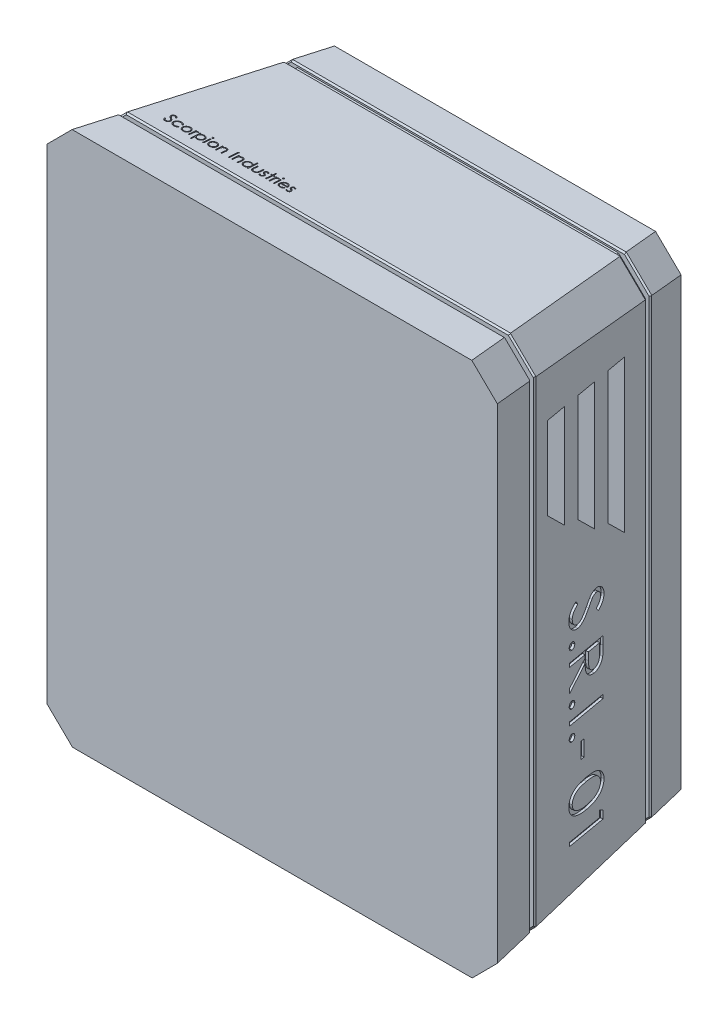
from build123d import *
from OCP.BRepFilletAPI import BRepFilletAPI_MakeChamfer

# Parameters (mm, degrees)
SKETCH1_W               = 114.3
SKETCH1_H               = 152.4
SKETCH1_W_2             = 104.14
SKETCH1_H_2             = 142.24
EXTRUDE_THIN1_DEPTH     = 68.58
SKETCH2_W               = 114.3
SKETCH2_H               = 152.4
BOSS_EXTRUDE1_DEPTH     = 6.35
SKETCH3_R               = 19.6215
SKETCH3_R_2             = 14.5415
EXTRUDE_THIN2_DEPTH     = 49.53
SKETCH4_W               = 41.91
SKETCH4_H               = 41.91
CUT_EXTRUDE1_DEPTH      = 3.81
SKETCH5_R               = 1.397
CUT_EXTRUDE2_DEPTH      = 6.35
DRAFT4_ANGLE            = 10
DRAFT5_ANGLE            = 5
CHAMFER2_SIZE           = 7.62
CHAMFER2_SIZE2          = 7.737996461
CUT_EXTRUDE_THIN4_DEPTH = 1.27
CHAMFER3_SIZE           = 0.508
CHAMFER3_SIZE2          = 0.435767757
CHAMFER3_SIZE2_2        = 0.634501052
CHAMFER3_SIZE2_3        = 0.62626395
CHAMFER3_SIZE2_4        = 0.558831937
CHAMFER3_SIZE2_5        = 0.435484195
CHAMFER3_SIZE2_6        = 0.635379071
CHAMFER3_SIZE2_7        = 0.438514739
CHAMFER3_SIZE2_8        = 0.468915672
CUT_EXTRUDE_THIN6_DEPTH = 1.27
CHAMFER4_SIZE           = 0.508
CHAMFER4_SIZE2          = 0.62626395
CHAMFER4_SIZE2_2        = 0.438514739
CHAMFER4_SIZE2_3        = 0.435484195
CHAMFER4_SIZE2_4        = 0.435767757
CHAMFER4_SIZE2_5        = 0.558831937
CHAMFER4_SIZE2_6        = 0.468915672
CHAMFER4_SIZE2_7        = 0.635379071
CHAMFER4_SIZE2_8        = 0.634501052
SKETCH14_W              = 12.7
SKETCH14_H              = 1.13974359
SKETCH14_W_2            = 1.302564102
SKETCH14_H_2            = 4.884615384
CUT_EXTRUDE6_DEPTH      = 0.762
CUT_EXTRUDE7_DEPTH      = 16.51
SKETCH16_W              = 44.45
SKETCH16_H              = 8.89
CUT_EXTRUDE8_DEPTH      = 16.51
SKETCH17_W              = 0.284935898
SKETCH17_H              = 2.320192308
SKETCH17_W_2            = 0.284935897
SKETCH17_H_2            = 3.175
CUT_EXTRUDE9_DEPTH      = 0.762


with BuildPart() as part:
    # Sketch1 → Extrude-Thin1 (new body)
    with BuildSketch(Plane.XY):
        Rectangle(SKETCH1_W, SKETCH1_H)
        Rectangle(SKETCH1_W_2, SKETCH1_H_2, mode=Mode.SUBTRACT)
    extrude(amount=EXTRUDE_THIN1_DEPTH)

    # Sketch2 → Boss-Extrude1 (add)
    with BuildSketch(Plane.XY.offset(68.58)):
        Rectangle(SKETCH2_W, SKETCH2_H)
    extrude(amount=-BOSS_EXTRUDE1_DEPTH)

    # Sketch3 → Extrude-Thin2 (add)
    with BuildSketch(Plane(origin=(0, 0, 62.23), x_dir=(-1, 0, 0), z_dir=(0, 0, -1))):
        with Locations((0, -20.32)):
            Circle(SKETCH3_R)
        with Locations((0, -20.32)):
            Circle(SKETCH3_R_2, mode=Mode.SUBTRACT)
    extrude(amount=EXTRUDE_THIN2_DEPTH)

    # Sketch4 → Cut-Extrude1 (cut)
    with BuildSketch(Plane(origin=(0, 0, 62.23), x_dir=(-1, 0, 0), z_dir=(0, 0, -1))):
        with Locations((0, 36.322)):
            Rectangle(SKETCH4_W, SKETCH4_H)
    extrude(amount=-CUT_EXTRUDE1_DEPTH, mode=Mode.SUBTRACT)

    # Sketch5 → Cut-Extrude2 (cut)
    with BuildSketch(Plane(origin=(0, 0, 0), x_dir=(-1, 0, 0), z_dir=(0, 0, -1))):
        with Locations((-44.45, 73.025)):
            Circle(SKETCH5_R)
        with Locations((44.45, 73.025)):
            Circle(SKETCH5_R)
        with Locations((44.45, -73.025)):
            Circle(SKETCH5_R)
        with Locations((-44.45, -73.025)):
            Circle(SKETCH5_R)
    extrude(amount=-CUT_EXTRUDE2_DEPTH, mode=Mode.SUBTRACT)

    # Draft4
    draft4_faces = [part.faces().sort_by_distance(p)[0] for p in [
        (57.15, 0, 34.29),
        (-57.15, 0, 34.29),
    ]]
    draft(draft4_faces, Plane(origin=(0, 0, 0), x_dir=(-1, 0, 0), z_dir=(0, 0, -1)), DRAFT4_ANGLE)

    # Draft5
    draft5_faces = [part.faces().sort_by_distance(p)[0] for p in [
        (0, 76.2, 35.383556341),
        (0, -76.2, 35.383556341),
    ]]
    draft(draft5_faces, Plane(origin=(0, 0, 0), x_dir=(-1, 0, 0), z_dir=(0, 0, -1)), DRAFT5_ANGLE)

    # Chamfer2: one chamfer whose edges measure the first distance from different faces: ONE call of the kernel's chamfer builder (chamfer() names one face for all edges)
    chamfer2_edges_1 = [part.edges().sort_by_distance(p)[0] for p in [
        (-63.196252168, 79.199986272, 34.29),
    ]]
    chamfer2_side_1 = [part.faces().sort_by_distance(p)[0] for p in [
        (0, 79.295660055, 35.383556341),
    ]]
    chamfer2_edges_2 = [part.edges().sort_by_distance(p)[0] for p in [
        (63.196252168, 79.199986272, 34.29),
    ]]
    chamfer2_side_2 = [part.faces().sort_by_distance(p)[0] for p in [
        (63.2725934, 0, 34.722952639),
    ]]
    chamfer2_edges_3 = [part.edges().sort_by_distance(p)[0] for p in [
        (63.196252168, -79.199986272, 34.29),
    ]]
    chamfer2_side_3 = [part.faces().sort_by_distance(p)[0] for p in [
        (0, -79.295660055, 35.383556341),
    ]]
    chamfer2_edges_4 = [part.edges().sort_by_distance(p)[0] for p in [
        (-63.196252168, -79.199986272, 34.29),
    ]]
    chamfer2_side_4 = [part.faces().sort_by_distance(p)[0] for p in [
        (-63.2725934, 0, 34.722952639),
    ]]
    chamfer2 = BRepFilletAPI_MakeChamfer(part.part.solid().wrapped)
    for e in chamfer2_edges_1:
        chamfer2.Add(CHAMFER2_SIZE, CHAMFER2_SIZE2, e.wrapped, chamfer2_side_1[0].wrapped)  # the first distance lies on this face
    for e in chamfer2_edges_2:
        chamfer2.Add(CHAMFER2_SIZE, CHAMFER2_SIZE2, e.wrapped, chamfer2_side_2[0].wrapped)  # the first distance lies on this face
    for e in chamfer2_edges_3:
        chamfer2.Add(CHAMFER2_SIZE, CHAMFER2_SIZE2, e.wrapped, chamfer2_side_3[0].wrapped)  # the first distance lies on this face
    for e in chamfer2_edges_4:
        chamfer2.Add(CHAMFER2_SIZE, CHAMFER2_SIZE2, e.wrapped, chamfer2_side_4[0].wrapped)  # the first distance lies on this face
    add(Compound.cast(chamfer2.Shape()), mode=Mode.REPLACE)

    # Sketch9 → Cut-Extrude-Thin4 (cut)
    with BuildSketch(Plane(origin=(0, 0, 11.43), x_dir=(-1, 0, 0), z_dir=(0, 0, -1))):
        Polygon((-62.23, 70.696050013), (-51.3578834, 81.28), (51.523301008, 81.28), (62.23, 70.531784102), (62.23, -70.696050013), (51.3578834, -81.28), (-51.523301008, -81.28), (-62.23, -70.531784102), align=None)
        Polygon((-57.15, 68.551768906), (-49.293532392, 76.2), (49.413335416, 76.2), (57.15, 68.433335284), (57.15, -68.551768906), (49.293532392, -76.2), (-49.413335416, -76.2), (-57.15, -68.433335284), align=None, mode=Mode.SUBTRACT)
    extrude(amount=-CUT_EXTRUDE_THIN4_DEPTH, mode=Mode.SUBTRACT)

    # Chamfer3: one chamfer whose edges measure the first distance from different faces: ONE call of the kernel's chamfer builder (chamfer() names one face for all edges)
    chamfer3_edges_1 = [part.edges().sort_by_distance(p)[0] for p in [
        (-55.237183586, -73.375879877, 11.43),
    ]]
    chamfer3_side_1 = [part.faces().sort_by_distance(p)[0] for p in [
        (-54.229474891, -72.875882165, 5.715),
    ]]
    chamfer3_edges_2 = [part.edges().sort_by_distance(p)[0] for p in [
        (-55.461118851, -73.48699048, 12.7),
        (55.461118851, 73.48699048, 12.7),
    ]]
    chamfer3_side_2 = [part.faces().sort_by_distance(p)[0] for p in [
        (-0.059901512, 77.116128055, 12.7),
    ]]
    chamfer3_edges_3 = [part.edges().sort_by_distance(p)[0] for p in [
        (59.389352655, 0.059216811, 12.7),
    ]]
    chamfer3_side_3 = [part.faces().sort_by_distance(p)[0] for p in [
        (64.371644456, 0.059216811, 40.955980914),
    ]]
    chamfer3_edges_4 = [part.edges().sort_by_distance(p)[0] for p in [
        (0.059901512, -77.311106027, 12.7),
    ]]
    chamfer3_side_4 = [part.faces().sort_by_distance(p)[0] for p in [
        (0.059901512, -79.82656324, 41.451807513),
    ]]
    chamfer3_edges_5 = [part.edges().sort_by_distance(p)[0] for p in [
        (-59.389352655, -0.059216811, 12.7),
    ]]
    chamfer3_side_5 = [part.faces().sort_by_distance(p)[0] for p in [
        (-64.371644456, -0.059216811, 40.955980914),
    ]]
    chamfer3_edges_6 = [part.edges().sort_by_distance(p)[0] for p in [
        (-0.059901512, 77.311106027, 12.7),
    ]]
    chamfer3_side_6 = [part.faces().sort_by_distance(p)[0] for p in [
        (-0.059901512, 79.82656324, 41.451807513),
    ]]
    chamfer3_edges_7 = [part.edges().sort_by_distance(p)[0] for p in [
        (55.237183586, 73.375879877, 11.43),
    ]]
    chamfer3_side_7 = [part.faces().sort_by_distance(p)[0] for p in [
        (54.229474891, 72.875882165, 5.715),
    ]]
    chamfer3_edges_8 = [part.edges().sort_by_distance(p)[0] for p in [
        (-55.297085097, 73.316663066, 11.43),
    ]]
    chamfer3_side_8 = [part.faces().sort_by_distance(p)[0] for p in [
        (-54.289376403, 72.816665354, 5.715),
    ]]
    chamfer3_edges_9 = [part.edges().sort_by_distance(p)[0] for p in [
        (55.297085097, -73.316663066, 11.43),
    ]]
    chamfer3_side_9 = [part.faces().sort_by_distance(p)[0] for p in [
        (54.289376403, -72.816665354, 5.715),
    ]]
    chamfer3_edges_10 = [part.edges().sort_by_distance(p)[0] for p in [
        (-55.521020363, 73.427773669, 12.7),
        (55.521020363, -73.427773669, 12.7),
    ]]
    chamfer3_side_10 = [part.faces().sort_by_distance(p)[0] for p in [
        (-0.059901512, 77.116128055, 12.7),
    ]]
    chamfer3_edges_11 = [part.edges().sort_by_distance(p)[0] for p in [
        (59.165417389, 0.059216811, 11.43),
        (-59.165417389, -0.059216811, 11.43),
    ]]
    chamfer3_side_11 = [part.faces().sort_by_distance(p)[0] for p in [
        (-0.059901512, 77.005466394, 11.43),
    ]]
    chamfer3_edges_12 = [part.edges().sort_by_distance(p)[0] for p in [
        (0.059901512, -77.199995424, 11.43),
        (-0.059901512, 77.199995424, 11.43),
    ]]
    chamfer3_side_12 = [part.faces().sort_by_distance(p)[0] for p in [
        (-0.059901512, 77.005466394, 11.43),
    ]]
    chamfer3 = BRepFilletAPI_MakeChamfer(part.part.solid().wrapped)
    for e in chamfer3_edges_1:
        chamfer3.Add(CHAMFER3_SIZE, CHAMFER3_SIZE2, e.wrapped, chamfer3_side_1[0].wrapped)  # the first distance lies on this face
    for e in chamfer3_edges_2:
        chamfer3.Add(CHAMFER3_SIZE, CHAMFER3_SIZE2_2, e.wrapped, chamfer3_side_2[0].wrapped)  # the first distance lies on this face
    for e in chamfer3_edges_3:
        chamfer3.Add(CHAMFER3_SIZE, CHAMFER3_SIZE2_3, e.wrapped, chamfer3_side_3[0].wrapped)  # the first distance lies on this face
    for e in chamfer3_edges_4:
        chamfer3.Add(CHAMFER3_SIZE, CHAMFER3_SIZE2_4, e.wrapped, chamfer3_side_4[0].wrapped)  # the first distance lies on this face
    for e in chamfer3_edges_5:
        chamfer3.Add(CHAMFER3_SIZE, CHAMFER3_SIZE2_3, e.wrapped, chamfer3_side_5[0].wrapped)  # the first distance lies on this face
    for e in chamfer3_edges_6:
        chamfer3.Add(CHAMFER3_SIZE, CHAMFER3_SIZE2_4, e.wrapped, chamfer3_side_6[0].wrapped)  # the first distance lies on this face
    for e in chamfer3_edges_7:
        chamfer3.Add(CHAMFER3_SIZE, CHAMFER3_SIZE2, e.wrapped, chamfer3_side_7[0].wrapped)  # the first distance lies on this face
    for e in chamfer3_edges_8:
        chamfer3.Add(CHAMFER3_SIZE, CHAMFER3_SIZE2_5, e.wrapped, chamfer3_side_8[0].wrapped)  # the first distance lies on this face
    for e in chamfer3_edges_9:
        chamfer3.Add(CHAMFER3_SIZE, CHAMFER3_SIZE2_5, e.wrapped, chamfer3_side_9[0].wrapped)  # the first distance lies on this face
    for e in chamfer3_edges_10:
        chamfer3.Add(CHAMFER3_SIZE, CHAMFER3_SIZE2_6, e.wrapped, chamfer3_side_10[0].wrapped)  # the first distance lies on this face
    for e in chamfer3_edges_11:
        chamfer3.Add(CHAMFER3_SIZE, CHAMFER3_SIZE2_7, e.wrapped, chamfer3_side_11[0].wrapped)  # the first distance lies on this face
    for e in chamfer3_edges_12:
        chamfer3.Add(CHAMFER3_SIZE, CHAMFER3_SIZE2_8, e.wrapped, chamfer3_side_12[0].wrapped)  # the first distance lies on this face
    add(Compound.cast(chamfer3.Shape()), mode=Mode.REPLACE)

    # Sketch11 → Cut-Extrude-Thin6 (cut)
    with BuildSketch(Plane.XY.offset(55.88)):
        Polygon((-69.242504337, 74.433307829), (-61.505839753, 82.199972545), (61.386036729, 82.199972545), (69.242504337, 74.551741451), (69.242504337, -74.433307829), (61.505839753, -82.199972545), (-61.386036729, -82.199972545), (-69.242504337, -74.551741451), align=None)
        Polygon((-64.416504337, 72.439781453), (-59.50137244, 77.373972545), (59.424903272, 77.373972545), (64.416504337, 72.5146744), (64.416504337, -72.439781453), (59.50137244, -77.373972545), (-59.424903272, -77.373972545), (-64.416504337, -72.5146744), align=None, mode=Mode.SUBTRACT)
    extrude(amount=-CUT_EXTRUDE_THIN6_DEPTH, mode=Mode.SUBTRACT)

    # Chamfer4: one chamfer whose edges measure the first distance from different faces: ONE call of the kernel's chamfer builder (chamfer() names one face for all edges)
    chamfer4_edges_1 = [part.edges().sort_by_distance(p)[0] for p in [
        (-67.003151682, -0.059216811, 55.88),
        (67.003151682, 0.059216811, 55.88),
    ]]
    chamfer4_side_1 = [part.faces().sort_by_distance(p)[0] for p in [
        (-64.899362091, -0.059216811, 55.88),
    ]]
    chamfer4_edges_2 = [part.edges().sort_by_distance(p)[0] for p in [
        (-66.779216416, -0.059216811, 54.61),
    ]]
    chamfer4_side_2 = [part.faces().sort_by_distance(p)[0] for p in [
        (-63.159250847, -0.059219511, 34.080155079),
    ]]
    chamfer4_edges_3 = [part.edges().sort_by_distance(p)[0] for p in [
        (62.910884124, -77.094423557, 54.61),
        (-62.910884124, 77.094423557, 54.61),
    ]]
    chamfer4_side_3 = [part.faces().sort_by_distance(p)[0] for p in [
        (-64.679991731, -0.059216811, 54.61),
    ]]
    chamfer4_edges_4 = [part.edges().sort_by_distance(p)[0] for p in [
        (-62.850982613, -77.153640368, 54.61),
        (62.850982613, 77.153640368, 54.61),
    ]]
    chamfer4_side_4 = [part.faces().sort_by_distance(p)[0] for p in [
        (-64.679991731, -0.059216811, 54.61),
    ]]
    chamfer4_edges_5 = [part.edges().sort_by_distance(p)[0] for p in [
        (-0.059901512, 81.088866518, 55.88),
        (0.059901512, -81.088866518, 55.88),
    ]]
    chamfer4_side_5 = [part.faces().sort_by_distance(p)[0] for p in [
        (-64.899362091, -0.059216811, 55.88),
    ]]
    chamfer4_edges_6 = [part.edges().sort_by_distance(p)[0] for p in [
        (66.779216416, 0.059216811, 54.61),
    ]]
    chamfer4_side_6 = [part.faces().sort_by_distance(p)[0] for p in [
        (63.159250847, 0.059219511, 34.080155079),
    ]]
    chamfer4_edges_7 = [part.edges().sort_by_distance(p)[0] for p in [
        (-0.059901512, 80.977755915, 54.61),
    ]]
    chamfer4_side_7 = [part.faces().sort_by_distance(p)[0] for p in [
        (-0.059901875, 79.206403505, 34.363349302),
    ]]
    chamfer4_edges_8 = [part.edges().sort_by_distance(p)[0] for p in [
        (0.059901512, -80.977755915, 54.61),
    ]]
    chamfer4_side_8 = [part.faces().sort_by_distance(p)[0] for p in [
        (0.059901875, -79.206403505, 34.363349302),
    ]]
    chamfer4_edges_9 = [part.edges().sort_by_distance(p)[0] for p in [
        (63.13481939, -77.20553416, 55.88),
    ]]
    chamfer4_side_9 = [part.faces().sort_by_distance(p)[0] for p in [
        (64.254495717, -77.761087173, 62.23),
    ]]
    chamfer4_edges_10 = [part.edges().sort_by_distance(p)[0] for p in [
        (-63.074917878, -77.264750971, 55.88),
    ]]
    chamfer4_side_10 = [part.faces().sort_by_distance(p)[0] for p in [
        (-64.194594206, -77.820303984, 62.23),
    ]]
    chamfer4_edges_11 = [part.edges().sort_by_distance(p)[0] for p in [
        (-63.13481939, 77.20553416, 55.88),
    ]]
    chamfer4_side_11 = [part.faces().sort_by_distance(p)[0] for p in [
        (-64.254495717, 77.761087173, 62.23),
    ]]
    chamfer4_edges_12 = [part.edges().sort_by_distance(p)[0] for p in [
        (63.074917878, 77.264750971, 55.88),
    ]]
    chamfer4_side_12 = [part.faces().sort_by_distance(p)[0] for p in [
        (64.194594206, 77.820303984, 62.23),
    ]]
    chamfer4 = BRepFilletAPI_MakeChamfer(part.part.solid().wrapped)
    for e in chamfer4_edges_1:
        chamfer4.Add(CHAMFER4_SIZE, CHAMFER4_SIZE2, e.wrapped, chamfer4_side_1[0].wrapped)  # the first distance lies on this face
    for e in chamfer4_edges_2:
        chamfer4.Add(CHAMFER4_SIZE, CHAMFER4_SIZE2_2, e.wrapped, chamfer4_side_2[0].wrapped)  # the first distance lies on this face
    for e in chamfer4_edges_3:
        chamfer4.Add(CHAMFER4_SIZE, CHAMFER4_SIZE2_3, e.wrapped, chamfer4_side_3[0].wrapped)  # the first distance lies on this face
    for e in chamfer4_edges_4:
        chamfer4.Add(CHAMFER4_SIZE, CHAMFER4_SIZE2_4, e.wrapped, chamfer4_side_4[0].wrapped)  # the first distance lies on this face
    for e in chamfer4_edges_5:
        chamfer4.Add(CHAMFER4_SIZE, CHAMFER4_SIZE2_5, e.wrapped, chamfer4_side_5[0].wrapped)  # the first distance lies on this face
    for e in chamfer4_edges_6:
        chamfer4.Add(CHAMFER4_SIZE, CHAMFER4_SIZE2_2, e.wrapped, chamfer4_side_6[0].wrapped)  # the first distance lies on this face
    for e in chamfer4_edges_7:
        chamfer4.Add(CHAMFER4_SIZE, CHAMFER4_SIZE2_6, e.wrapped, chamfer4_side_7[0].wrapped)  # the first distance lies on this face
    for e in chamfer4_edges_8:
        chamfer4.Add(CHAMFER4_SIZE, CHAMFER4_SIZE2_6, e.wrapped, chamfer4_side_8[0].wrapped)  # the first distance lies on this face
    for e in chamfer4_edges_9:
        chamfer4.Add(CHAMFER4_SIZE, CHAMFER4_SIZE2_7, e.wrapped, chamfer4_side_9[0].wrapped)  # the first distance lies on this face
    for e in chamfer4_edges_10:
        chamfer4.Add(CHAMFER4_SIZE, CHAMFER4_SIZE2_8, e.wrapped, chamfer4_side_10[0].wrapped)  # the first distance lies on this face
    for e in chamfer4_edges_11:
        chamfer4.Add(CHAMFER4_SIZE, CHAMFER4_SIZE2_7, e.wrapped, chamfer4_side_11[0].wrapped)  # the first distance lies on this face
    for e in chamfer4_edges_12:
        chamfer4.Add(CHAMFER4_SIZE, CHAMFER4_SIZE2_8, e.wrapped, chamfer4_side_12[0].wrapped)  # the first distance lies on this face
    add(Compound.cast(chamfer4.Shape()), mode=Mode.REPLACE)

    # Sketch14 → Cut-Extrude6 (cut)
    # profile 1 of 9: a face of its own
    with BuildSketch(Plane(origin=(55.426716639, 0, -9.773225596), x_dir=(-0.17364817766693078, 0, -0.9848077530122081), z_dir=(0.9848077530122081, 0, -0.17364817766693078))):
        with BuildLine():
            Line((-49.718500725, 4.61819117), (-49.074850885, 3.544593414))
            add(Edge.make_bspline(
                [(-49.074850885, 3.544593414), (-49.241998796, 3.444741524), (-49.562247744, 3.253429157), (-49.994984062, 2.934291368), (-50.362783888, 2.603609091), (-50.663507578, 2.258933509), (-50.900267824, 1.902368497), (-51.067915922, 1.531586359), (-51.172476747, 1.147836589), (-51.185177061, 0.886674437), (-51.191517552, 0.756292132)],
                knots=[0, 0, 0, 0, 1.272034388, 2.437168799, 3.508375237, 4.49857839, 5.41946034, 6.295179144, 7.148887113, 8, 8, 8, 8], degree=3))
            add(Edge.make_bspline(
                [(-51.191517552, 0.756292132), (-51.188416315, 0.644942655), (-51.182268107, 0.424192055), (-51.123191997, 0.099209228), (-51.032433915, -0.21641109), (-50.902454303, -0.516160055), (-50.745200415, -0.795915588), (-50.555248368, -1.041201124), (-50.342627772, -1.253384144), (-50.105250455, -1.426473334), (-49.850840742, -1.560843594), (-49.587365234, -1.658077632), (-49.315982873, -1.719961249), (-49.131993824, -1.727837792), (-49.039233898, -1.73180883)],
                knots=[0, 0, 0, 0, 1.095270387, 2.171376115, 3.241375676, 4.322296363, 5.380636668, 6.392615365, 7.366724986, 8.328592944, 9.273498763, 10.190095884, 11.087518669, 12, 12, 12, 12], degree=3))
            add(Edge.make_bspline(
                [(-49.039233898, -1.73180883), (-48.933494243, -1.726459188), (-48.718540977, -1.715584149), (-48.401405093, -1.623667064), (-48.087560625, -1.479071225), (-47.893427461, -1.345675347), (-47.792639347, -1.276420208)],
                knots=[0, 0, 0, 0, 0.938893495, 1.908633276, 2.914225137, 4, 4, 4, 4], degree=3))
            add(Edge.make_bspline(
                [(-47.792639347, -1.276420208), (-47.719749314, -1.21971924), (-47.566276629, -1.100333233), (-47.341648208, -0.892246681), (-47.104282151, -0.654423863), (-46.855142347, -0.385675838), (-46.598778709, -0.080660456), (-46.329847311, 0.254359166), (-46.049156393, 0.621117284), (-45.863538229, 0.879591832), (-45.767559218, 1.013243253)],
                knots=[0, 0, 0, 0, 0.72226686, 1.520759855, 2.393439377, 3.351307446, 4.386958158, 5.510256019, 6.712608938, 8, 8, 8, 8], degree=3))
            add(Edge.make_bspline(
                [(-45.767559218, 1.013243253), (-45.672365131, 1.14684393), (-45.490361285, 1.402278252), (-45.220589075, 1.759772671), (-44.972368835, 2.079022767), (-44.749158181, 2.361655278), (-44.541221795, 2.600358142), (-44.359703906, 2.80385767), (-44.194911666, 2.964645994), (-44.088093889, 3.054120904), (-44.04013534, 3.094292933)],
                knots=[0, 0, 0, 0, 1.452255772, 2.776602448, 3.96446981, 5.032613149, 5.964194703, 6.766668629, 7.446264616, 8, 8, 8, 8], degree=3))
            add(Edge.make_bspline(
                [(-44.04013534, 3.094292933), (-43.965383007, 3.150436168), (-43.81837251, 3.260849376), (-43.58859374, 3.406594596), (-43.353377892, 3.530470986), (-43.112092897, 3.62758002), (-42.868126155, 3.7093543), (-42.618294492, 3.764355934), (-42.363718934, 3.798796146), (-42.192401375, 3.802323068), (-42.106641751, 3.804088606)],
                knots=[0, 0, 0, 0, 1.068054152, 2.10047183, 3.106115577, 4.101338837, 5.06977816, 6.043150881, 7.020423561, 8, 8, 8, 8], degree=3))
            add(Edge.make_bspline(
                [(-42.106641751, 3.804088606), (-41.972265318, 3.799373221), (-41.706384656, 3.790043239), (-41.318178867, 3.710493627), (-40.946414934, 3.58640149), (-40.599281683, 3.406927927), (-40.277590889, 3.185032149), (-39.986257462, 2.922786196), (-39.739257231, 2.61142685), (-39.525951059, 2.267900619), (-39.357536916, 1.894311261), (-39.229819926, 1.503535951), (-39.158418307, 1.093861125), (-39.148056993, 0.815913873), (-39.142799603, 0.674881875)],
                knots=[0, 0, 0, 0, 1.005541892, 1.989591032, 2.955705311, 3.932863626, 4.905387107, 5.876519979, 6.856563935, 7.871847665, 8.897921447, 9.918317993, 10.943742853, 12, 12, 12, 12], degree=3))
            add(Edge.make_bspline(
                [(-39.142799603, 0.674881875), (-39.147864739, 0.525202403), (-39.157909508, 0.228370111), (-39.248373481, -0.209076117), (-39.394501438, -0.631056373), (-39.562805401, -0.970729802), (-39.730147466, -1.236113088), (-39.882630267, -1.438484925), (-40.058159576, -1.643563574), (-40.257221223, -1.852997351), (-40.481636295, -2.063239263), (-40.729869449, -2.277410049), (-41.000403214, -2.496010689), (-41.19353212, -2.636639095), (-41.292539186, -2.708731907)],
                knots=[0, 0, 0, 0, 1.286821612, 2.551921131, 3.825787379, 5.12137259, 5.803616487, 6.523126609, 7.299589446, 8.125436757, 9.008162487, 9.944516264, 10.946261234, 12, 12, 12, 12], degree=3))
            Line((-41.292539186, -2.708731907), (-42.073568834, -1.678383349))
            add(Edge.make_bspline(
                [(-42.073568834, -1.678383349), (-41.993418441, -1.616168109), (-41.839067523, -1.496356104), (-41.622908779, -1.31445767), (-41.425454596, -1.143012608), (-41.253950035, -0.974101052), (-41.099001209, -0.816644506), (-40.966345083, -0.663818675), (-40.854662067, -0.517829142), (-40.735535155, -0.333783833), (-40.616697246, -0.101970507), (-40.518279167, 0.188735224), (-40.457007057, 0.491703103), (-40.449287486, 0.697487335), (-40.445363706, 0.802085401)],
                knots=[0, 0, 0, 0, 1.181667846, 2.275615987, 3.290305621, 4.226321945, 5.078535498, 5.862783384, 6.581873284, 7.217493746, 8.414623899, 9.604724551, 10.782505457, 12, 12, 12, 12], degree=3))
            add(Edge.make_bspline(
                [(-40.445363706, 0.802085401), (-40.449760445, 0.933281925), (-40.458239144, 1.186282063), (-40.550840234, 1.545475205), (-40.696642984, 1.868758876), (-40.900985904, 2.146535326), (-41.143087792, 2.3778095), (-41.421685352, 2.545106451), (-41.729324356, 2.645799905), (-41.94392408, 2.658087262), (-42.05321627, 2.664345016)],
                knots=[0, 0, 0, 0, 1.14458467, 2.207223713, 3.21896685, 4.227309161, 5.202851033, 6.127160689, 7.046193047, 8, 8, 8, 8], degree=3))
            add(Edge.make_bspline(
                [(-42.05321627, 2.664345016), (-42.121240002, 2.66285212), (-42.257398698, 2.659863886), (-42.459091526, 2.620998717), (-42.658993997, 2.565889075), (-42.857994995, 2.48523272), (-43.060776171, 2.376592232), (-43.266790041, 2.228873827), (-43.481237958, 2.044072022), (-43.620575647, 1.902232704), (-43.694141751, 1.827345817)],
                knots=[0, 0, 0, 0, 0.858526328, 1.718456515, 2.587092892, 3.476767204, 4.426280253, 5.487868114, 6.673670035, 8, 8, 8, 8], degree=3))
            add(Edge.make_bspline(
                [(-43.694141751, 1.827345817), (-43.718950387, 1.79954598), (-43.777890029, 1.733499931), (-43.874382018, 1.612755858), (-43.993409221, 1.453306276), (-44.140683198, 1.25931486), (-44.311521646, 1.027204719), (-44.503740182, 0.756950329), (-44.723578847, 0.451564196), (-44.877276209, 0.234858958), (-44.958544795, 0.120274503)],
                knots=[0, 0, 0, 0, 0.420754252, 0.999615792, 1.744751191, 2.668019286, 3.750313428, 4.999500688, 6.413464383, 8, 8, 8, 8], degree=3))
            add(Edge.make_bspline(
                [(-44.958544795, 0.120274503), (-45.058843443, -0.017560096), (-45.253057873, -0.284457695), (-45.544851912, -0.6642152), (-45.830230958, -1.00854416), (-46.107372561, -1.318653499), (-46.374174498, -1.597606852), (-46.633846609, -1.842309439), (-46.884528545, -2.055254622), (-47.205920462, -2.284504929), (-47.600640397, -2.518757588), (-48.084250005, -2.719931058), (-48.569739511, -2.846779919), (-48.89604546, -2.863367989), (-49.057042392, -2.87155242)],
                knots=[0, 0, 0, 0, 1.163667725, 2.253281268, 3.268753668, 4.215851969, 5.092017293, 5.902905408, 6.650798638, 7.335211899, 8.59617414, 9.77448103, 10.901945474, 12, 12, 12, 12], degree=3))
            add(Edge.make_bspline(
                [(-49.057042392, -2.87155242), (-49.170900133, -2.869166622), (-49.396404575, -2.864441358), (-49.727543193, -2.810173877), (-50.04909809, -2.730565168), (-50.357385927, -2.610955493), (-50.65653185, -2.463824295), (-50.943780303, -2.282096146), (-51.215182517, -2.06302298), (-51.476386344, -1.819532029), (-51.712328494, -1.548932653), (-51.923352322, -1.263611507), (-52.099977941, -0.961716256), (-52.24216202, -0.644708105), (-52.355128006, -0.31434068), (-52.436325596, 0.029733694), (-52.486274203, 0.388473162), (-52.491450117, 0.632317058), (-52.494081654, 0.756292132)],
                knots=[0, 0, 0, 0, 0.983610584, 1.948120116, 2.894308362, 3.843560551, 4.801159957, 5.773581695, 6.77566113, 7.813174769, 8.857584665, 9.875476876, 10.877851407, 11.875574773, 12.875048225, 13.892438445, 14.928473903, 16, 16, 16, 16], degree=3))
            add(Edge.make_bspline(
                [(-52.494081654, 0.756292132), (-52.492205542, 0.852210428), (-52.488476945, 1.04283903), (-52.456294667, 1.324044961), (-52.409098966, 1.600087097), (-52.337142617, 1.867499398), (-52.247784259, 2.129611632), (-52.138377878, 2.384087411), (-52.008135144, 2.631544996), (-51.856840331, 2.87227335), (-51.68247839, 3.108540825), (-51.480977766, 3.339136146), (-51.253730264, 3.566697345), (-50.998405408, 3.787052873), (-50.717731083, 4.004264458), (-50.409355513, 4.214292659), (-50.074879495, 4.421414267), (-49.839512451, 4.551373743), (-49.718500725, 4.61819117)],
                knots=[0, 0, 0, 0, 0.915384692, 1.819241058, 2.699029451, 3.586605375, 4.459625921, 5.340865773, 6.228072412, 7.126546901, 8.052715223, 9.028303326, 10.047266019, 11.120332924, 12.245748783, 13.433636234, 14.680528497, 16, 16, 16, 16], degree=3))
        make_face()
    # profile 2 of 9: a face of its own
    with BuildSketch(Plane(origin=(55.426716639, 0, -9.773225596), x_dir=(-0.17364817766693078, 0, -0.9848077530122081), z_dir=(0.9848077530122081, 0, -0.17364817766693078))):
        with BuildLine():
            add(Edge.make_bspline(
                [(-50.214594475, -6.372193445), (-50.218658095, -6.442964021), (-50.226577513, -6.580885798), (-50.284781295, -6.780600701), (-50.38298783, -6.963104074), (-50.517924614, -7.124663662), (-50.679020776, -7.258940381), (-50.861060541, -7.358276922), (-51.061354446, -7.419148603), (-51.201265774, -7.426672876), (-51.272927808, -7.430526779)],
                knots=[0, 0, 0, 0, 1.020591893, 1.988988293, 2.974634352, 3.991697318, 5.008760285, 5.983632262, 6.967224335, 8, 8, 8, 8], degree=3))
            add(Edge.make_bspline(
                [(-51.272927808, -7.430526779), (-51.342866702, -7.426518921), (-51.481023263, -7.41860184), (-51.679801622, -7.358403299), (-51.861962426, -7.258162625), (-52.025248661, -7.12558017), (-52.160474304, -6.963064759), (-52.257805145, -6.780159473), (-52.320081614, -6.58136458), (-52.327474375, -6.443044589), (-52.331261142, -6.372193445)],
                knots=[0, 0, 0, 0, 1.009852967, 1.994853009, 2.971120474, 3.99910934, 5.017628188, 6.004685157, 6.977947174, 8, 8, 8, 8], degree=3))
            add(Edge.make_bspline(
                [(-52.331261142, -6.372193445), (-52.327332213, -6.301393318), (-52.319616792, -6.162359802), (-52.259048751, -5.962820094), (-52.159541185, -5.781021966), (-52.025498598, -5.618474907), (-51.861116554, -5.486993647), (-51.681041786, -5.382135007), (-51.48044905, -5.326753543), (-51.342753605, -5.318198435), (-51.272927808, -5.313860112)],
                knots=[0, 0, 0, 0, 1.021616397, 2.006195831, 2.982046417, 4.000130345, 5.027680246, 6.00943514, 6.990578253, 8, 8, 8, 8], degree=3))
            add(Edge.make_bspline(
                [(-51.272927808, -5.313860112), (-51.201382911, -5.318056241), (-51.061938091, -5.326234721), (-50.859820883, -5.382263439), (-50.679858586, -5.486201517), (-50.51767718, -5.619393589), (-50.383917955, -5.78098202), (-50.28355653, -5.962391214), (-50.227035457, -6.162830337), (-50.218796965, -6.301471818), (-50.214594475, -6.372193445)],
                knots=[0, 0, 0, 0, 1.032329927, 2.012066096, 2.992413168, 4.009037178, 5.025661188, 6.000112418, 6.979848586, 8, 8, 8, 8], degree=3))
        make_face()
    # profile 3 of 9: a face of its own
    with BuildSketch(Plane(origin=(55.426716639, 0, -9.773225596), x_dir=(-0.17364817766693078, 0, -0.9848077530122081), z_dir=(0.9848077530122081, 0, -0.17364817766693078))):
        with BuildLine():
            Line((-39.468440629, -10.36129601), (-39.468440629, -12.902822452))
            add(Edge.make_bspline(
                [(-39.468440629, -12.902822452), (-39.469005184, -13.072425975), (-39.470089192, -13.398083528), (-39.476133531, -13.864620823), (-39.493457622, -14.288536289), (-39.508365911, -14.669608278), (-39.535550955, -15.007829797), (-39.561533874, -15.304237967), (-39.595546872, -15.557467612), (-39.627135121, -15.710759701), (-39.641437424, -15.780166202)],
                knots=[0, 0, 0, 0, 1.410062039, 2.707475311, 3.878576406, 4.937260626, 5.877586885, 6.699081471, 7.410979367, 8, 8, 8, 8], degree=3))
            add(Edge.make_bspline(
                [(-39.641437424, -15.780166202), (-39.664391939, -15.873083303), (-39.709811289, -16.056935332), (-39.805859623, -16.321616113), (-39.916825724, -16.573941402), (-40.048171149, -16.812964295), (-40.197604951, -17.038706965), (-40.366000218, -17.250831415), (-40.554214523, -17.448124868), (-40.757441663, -17.632105401), (-40.977454859, -17.798877833), (-41.211049113, -17.943197553), (-41.45676343, -18.066777805), (-41.715453478, -18.165435636), (-41.984932459, -18.244802837), (-42.26755343, -18.300783173), (-42.562052956, -18.334350352), (-42.762922926, -18.337768137), (-42.864774763, -18.339501138)],
                knots=[0, 0, 0, 0, 1.02737288, 2.032829108, 3.019628684, 3.985738875, 4.958353778, 5.924249254, 6.890702889, 7.883913451, 8.865824512, 9.85161466, 10.829249435, 11.81541824, 12.821369441, 13.843154991, 14.906364023, 16, 16, 16, 16], degree=3))
            add(Edge.make_bspline(
                [(-42.864774763, -18.339501138), (-43.033993766, -18.334170911), (-43.36418387, -18.32377026), (-43.843373491, -18.22679438), (-44.290384665, -18.067955217), (-44.704595306, -17.849041821), (-45.078149551, -17.570393212), (-45.405144695, -17.235520947), (-45.681306993, -16.846135195), (-45.870778669, -16.481940726), (-45.992692866, -16.16007779), (-46.078902761, -15.894322416), (-46.144387505, -15.604208101), (-46.203903987, -15.293896975), (-46.249319845, -14.960992163), (-46.281573735, -14.606164055), (-46.302313232, -14.228525205), (-46.305343362, -13.969663784), (-46.306902167, -13.83649633)],
                knots=[0, 0, 0, 0, 1.260402266, 2.459371274, 3.627181936, 4.786749125, 5.93865593, 7.087644312, 8.261344208, 9.485713728, 10.136162886, 10.825977872, 11.566646758, 12.35154167, 13.181268117, 14.0701832, 15.007234106, 16, 16, 16, 16], degree=3))
            Line((-46.306902167, -13.83649633), (-52.168440629, -18.502321651))
            Line((-52.168440629, -18.502321651), (-52.168440629, -17.092906586))
            Line((-52.168440629, -17.092906586), (-46.306902167, -12.427081266))
            Line((-46.306902167, -12.427081266), (-46.306902167, -11.501039599))
            Line((-46.306902167, -11.501039599), (-52.168440629, -11.501039599))
            Line((-52.168440629, -11.501039599), (-52.168440629, -10.36129601))
            Line((-52.168440629, -10.36129601), (-39.468440629, -10.36129601))
        make_face()
        with BuildLine():
            Line((-40.771004731, -11.501039599), (-45.004338065, -11.501039599))
            Line((-45.004338065, -11.501039599), (-45.022146558, -13.826320048))
            add(Edge.make_bspline(
                [(-45.022146558, -13.826320048), (-45.022194588, -13.934887046), (-45.022287683, -14.145320809), (-45.007795986, -14.449760371), (-44.991310215, -14.733224755), (-44.966094072, -14.99462984), (-44.93359615, -15.234092014), (-44.892945894, -15.451492856), (-44.845583689, -15.647183108), (-44.772288495, -15.875425154), (-44.656099319, -16.130214425), (-44.487341162, -16.40745921), (-44.27370675, -16.642754553), (-44.033301682, -16.845624745), (-43.763545021, -17.001886461), (-43.47641025, -17.115617575), (-43.174376297, -17.186990186), (-42.966924178, -17.195475381), (-42.862230693, -17.199757548)],
                knots=[0, 0, 0, 0, 1.14660753, 2.222451964, 3.218720504, 4.145691244, 4.995719623, 5.770487122, 6.480909919, 7.121111896, 8.299844659, 9.430703709, 10.534634535, 11.641396424, 12.741395289, 13.810956493, 14.895269934, 16, 16, 16, 16], degree=3))
            add(Edge.make_bspline(
                [(-42.862230693, -17.199757548), (-42.760070517, -17.195462218), (-42.557626326, -17.186950441), (-42.262066714, -17.115479288), (-41.981117816, -17.000063824), (-41.720134707, -16.838224632), (-41.481258622, -16.642666791), (-41.279695408, -16.410412777), (-41.110897965, -16.153159185), (-41.003818301, -15.912547808), (-40.938037564, -15.697634213), (-40.89180534, -15.51100914), (-40.854348147, -15.299337261), (-40.825225886, -15.063125854), (-40.79901918, -14.802802267), (-40.782027446, -14.517653682), (-40.771757639, -14.208009384), (-40.771261541, -13.993389609), (-40.771004731, -13.882289599)],
                knots=[0, 0, 0, 0, 1.100801541, 2.181386982, 3.260112282, 4.364594493, 5.481957178, 6.577424609, 7.668452592, 8.790448866, 9.403819393, 10.091598921, 10.863153553, 11.720938239, 12.658472417, 13.685008818, 14.801622349, 16, 16, 16, 16], degree=3))
            Line((-40.771004731, -13.882289599), (-40.771004731, -11.501039599))
        make_face(mode=Mode.SUBTRACT)
    # profile 4 of 9: a face of its own
    with BuildSketch(Plane(origin=(55.426716639, 0, -9.773225596), x_dir=(-0.17364817766693078, 0, -0.9848077530122081), z_dir=(0.9848077530122081, 0, -0.17364817766693078))):
        with BuildLine():
            add(Edge.make_bspline(
                [(-50.214594475, -22.002962676), (-50.218658095, -22.073733252), (-50.226577513, -22.211655029), (-50.284781295, -22.411369932), (-50.38298783, -22.593873305), (-50.517924614, -22.755432893), (-50.679020776, -22.889709612), (-50.861060541, -22.989046152), (-51.061354446, -23.049917834), (-51.201265774, -23.057442107), (-51.272927808, -23.06129601)],
                knots=[0, 0, 0, 0, 1.020591893, 1.988988293, 2.974634352, 3.991697318, 5.008760285, 5.983632262, 6.967224335, 8, 8, 8, 8], degree=3))
            add(Edge.make_bspline(
                [(-51.272927808, -23.06129601), (-51.342866702, -23.057288152), (-51.481023263, -23.049371071), (-51.679801622, -22.98917253), (-51.861962426, -22.888931855), (-52.025248661, -22.756349401), (-52.160474304, -22.59383399), (-52.257805145, -22.410928704), (-52.320081614, -22.212133811), (-52.327474375, -22.07381382), (-52.331261142, -22.002962676)],
                knots=[0, 0, 0, 0, 1.009852967, 1.994853009, 2.971120474, 3.99910934, 5.017628188, 6.004685157, 6.977947174, 8, 8, 8, 8], degree=3))
            add(Edge.make_bspline(
                [(-52.331261142, -22.002962676), (-52.327332213, -21.932162549), (-52.319616792, -21.793129033), (-52.259048751, -21.593589325), (-52.159541185, -21.411791196), (-52.025498598, -21.249244137), (-51.861116554, -21.117762877), (-51.681041786, -21.012904238), (-51.48044905, -20.957522774), (-51.342753605, -20.948967666), (-51.272927808, -20.944629343)],
                knots=[0, 0, 0, 0, 1.021616397, 2.006195831, 2.982046417, 4.000130345, 5.027680246, 6.00943514, 6.990578253, 8, 8, 8, 8], degree=3))
            add(Edge.make_bspline(
                [(-51.272927808, -20.944629343), (-51.201382911, -20.948825472), (-51.061938091, -20.957003952), (-50.859820883, -21.01303267), (-50.679858586, -21.116970748), (-50.51767718, -21.25016282), (-50.383917955, -21.411751251), (-50.28355653, -21.593160445), (-50.227035457, -21.793599567), (-50.218796965, -21.932241049), (-50.214594475, -22.002962676)],
                knots=[0, 0, 0, 0, 1.032329927, 2.012066096, 2.992413168, 4.009037178, 5.025661188, 6.000112418, 6.979848586, 8, 8, 8, 8], degree=3))
        make_face()
    # profile 5 of 9: a face of its own
    with BuildSketch(Plane(origin=(55.426716639, 0, -9.773225596), x_dir=(-0.17364817766693078, 0, -0.9848077530122081), z_dir=(0.9848077530122081, 0, -0.17364817766693078))):
        with Locations((-45.818440629, -26.561937035)):
            Rectangle(SKETCH14_W, SKETCH14_H)
    # profile 6 of 9: a face of its own
    with BuildSketch(Plane(origin=(55.426716639, 0, -9.773225596), x_dir=(-0.17364817766693078, 0, -0.9848077530122081), z_dir=(0.9848077530122081, 0, -0.17364817766693078))):
        with BuildLine():
            add(Edge.make_bspline(
                [(-50.214594475, -30.795270368), (-50.218658095, -30.866040944), (-50.226577513, -31.003962721), (-50.284781295, -31.203677624), (-50.38298783, -31.386180997), (-50.517924614, -31.547740585), (-50.679020776, -31.682017304), (-50.861060541, -31.781353845), (-51.061354446, -31.842225526), (-51.201265774, -31.849749799), (-51.272927808, -31.853603702)],
                knots=[0, 0, 0, 0, 1.020591893, 1.988988293, 2.974634352, 3.991697318, 5.008760285, 5.983632262, 6.967224335, 8, 8, 8, 8], degree=3))
            add(Edge.make_bspline(
                [(-51.272927808, -31.853603702), (-51.342866702, -31.849595844), (-51.481023263, -31.841678763), (-51.679801622, -31.781480223), (-51.861962426, -31.681239548), (-52.025248661, -31.548657094), (-52.160474304, -31.386141682), (-52.257805145, -31.203236396), (-52.320081614, -31.004441503), (-52.327474375, -30.866121512), (-52.331261142, -30.795270368)],
                knots=[0, 0, 0, 0, 1.009852967, 1.994853009, 2.971120474, 3.99910934, 5.017628188, 6.004685157, 6.977947174, 8, 8, 8, 8], degree=3))
            add(Edge.make_bspline(
                [(-52.331261142, -30.795270368), (-52.327332213, -30.724470241), (-52.319616792, -30.585436725), (-52.259048751, -30.385897017), (-52.159541185, -30.204098889), (-52.025498598, -30.04155183), (-51.861116554, -29.91007057), (-51.681041786, -29.80521193), (-51.48044905, -29.749830467), (-51.342753605, -29.741275358), (-51.272927808, -29.736937035)],
                knots=[0, 0, 0, 0, 1.021616397, 2.006195831, 2.982046417, 4.000130345, 5.027680246, 6.00943514, 6.990578253, 8, 8, 8, 8], degree=3))
            add(Edge.make_bspline(
                [(-51.272927808, -29.736937035), (-51.201382911, -29.741133165), (-51.061938091, -29.749311645), (-50.859820883, -29.805340362), (-50.679858586, -29.90927844), (-50.51767718, -30.042470512), (-50.383917955, -30.204058943), (-50.28355653, -30.385468137), (-50.227035457, -30.58590726), (-50.218796965, -30.724548741), (-50.214594475, -30.795270368)],
                knots=[0, 0, 0, 0, 1.032329927, 2.012066096, 2.992413168, 4.009037178, 5.025661188, 6.000112418, 6.979848586, 8, 8, 8, 8], degree=3))
        make_face()
    # profile 7 of 9: a face of its own
    with BuildSketch(Plane(origin=(55.426716639, 0, -9.773225596), x_dir=(-0.17364817766693078, 0, -0.9848077530122081), z_dir=(0.9848077530122081, 0, -0.17364817766693078))):
        with Locations((-47.283825244, -36.086937035)):
            Rectangle(SKETCH14_W_2, SKETCH14_H_2)
    # profile 8 of 9: a face of its own
    with BuildSketch(Plane(origin=(55.426716639, 0, -9.773225596), x_dir=(-0.17364817766693078, 0, -0.9848077530122081), z_dir=(0.9848077530122081, 0, -0.17364817766693078))):
        with BuildLine():
            add(Edge.make_bspline(
                [(-45.82352877, -44.390783189), (-45.619975391, -44.391973426), (-45.22457002, -44.394285479), (-44.648408605, -44.420006322), (-44.107895554, -44.46273399), (-43.603005008, -44.521289609), (-43.133606577, -44.592547392), (-42.70095484, -44.687672262), (-42.303046804, -44.795849795), (-41.938586735, -44.921226992), (-41.602658212, -45.062692907), (-41.289071298, -45.21668298), (-40.998224114, -45.389224435), (-40.72574736, -45.570750837), (-40.474682006, -45.767895644), (-40.245503509, -45.978579462), (-40.038073488, -46.204892192), (-39.849923171, -46.442357882), (-39.68602026, -46.692477249), (-39.538332843, -46.947539948), (-39.417116748, -47.212046765), (-39.317516019, -47.483585317), (-39.237708479, -47.761365938), (-39.182441912, -48.046536398), (-39.147804632, -48.339165589), (-39.144483774, -48.536671721), (-39.142799603, -48.636836875)],
                knots=[0, 0, 0, 0, 1.646377244, 3.198111528, 4.663803227, 6.031090796, 7.308794487, 8.502186765, 9.612154809, 10.642545331, 11.617106989, 12.558866172, 13.465886467, 14.35053239, 15.20542558, 16.045215227, 16.865619885, 17.686225247, 18.492864914, 19.282407821, 20.068097601, 20.842842034, 21.620163247, 22.403093475, 23.190129512, 24, 24, 24, 24], degree=3))
            add(Edge.make_bspline(
                [(-39.142799603, -48.636836875), (-39.144569675, -48.737839897), (-39.148089792, -48.938703129), (-39.181922384, -49.235666776), (-39.238060459, -49.525769907), (-39.317602281, -49.807775725), (-39.416283736, -50.084000676), (-39.539971275, -50.352284212), (-39.68394888, -50.614292765), (-39.853126949, -50.865862666), (-40.041748351, -51.109755699), (-40.254972892, -51.339981164), (-40.490647588, -51.556560019), (-40.746250922, -51.762210413), (-41.026685373, -51.951097865), (-41.327073429, -52.130978605), (-41.652668281, -52.291985707), (-41.998037407, -52.447051528), (-42.372736969, -52.580898594), (-42.774654814, -52.701607542), (-43.208538292, -52.799139799), (-43.672110954, -52.880380873), (-44.16707525, -52.943318067), (-44.692370166, -52.989156511), (-45.248341298, -53.013370277), (-45.628462637, -53.017930307), (-45.82352877, -53.020270368)],
                knots=[0, 0, 0, 0, 0.810914788, 1.612654377, 2.396697861, 3.181598691, 3.963628158, 4.749916497, 5.551656086, 6.361998678, 7.18212741, 8.025565596, 8.878627764, 9.750805457, 10.657531673, 11.591944965, 12.560506719, 13.57287815, 14.630710178, 15.753379473, 16.941251878, 18.199788006, 19.531962791, 20.947069417, 22.433333509, 24, 24, 24, 24], degree=3))
            add(Edge.make_bspline(
                [(-45.82352877, -53.020270368), (-46.017743367, -53.017903125), (-46.396162589, -53.013290648), (-46.94964216, -52.989459713), (-47.472114098, -52.942296557), (-47.965032766, -52.883963174), (-48.425471547, -52.800868075), (-48.857808656, -52.706403592), (-49.258313095, -52.58899438), (-49.631036522, -52.456971655), (-49.974713563, -52.305270608), (-50.297493801, -52.142840502), (-50.597636752, -51.964063907), (-50.878067126, -51.774049972), (-51.135887206, -51.570147581), (-51.371734184, -51.352651643), (-51.585452498, -51.121396608), (-51.77665106, -50.876952159), (-51.943859778, -50.62142471), (-52.093317477, -50.360290709), (-52.214593131, -50.088338155), (-52.316988518, -49.811610976), (-52.396713329, -49.527498068), (-52.451300369, -49.236278109), (-52.489690447, -48.938904833), (-52.49261285, -48.737874841), (-52.494081654, -48.636836875)],
                knots=[0, 0, 0, 0, 1.56130642, 3.042141888, 4.451772327, 5.777565838, 7.030558081, 8.211376819, 9.333164717, 10.383253789, 11.387583522, 12.350962576, 13.286244149, 14.193812918, 15.072134482, 15.925989337, 16.770211267, 17.600669898, 18.417446232, 19.22325363, 20.01647746, 20.807971184, 21.593601364, 22.38506573, 23.188331689, 24, 24, 24, 24], degree=3))
            add(Edge.make_bspline(
                [(-52.494081654, -48.636836875), (-52.492381276, -48.536675791), (-52.489028463, -48.339177683), (-52.454625273, -48.046489713), (-52.398525261, -47.761764005), (-52.322341723, -47.484431371), (-52.225516964, -47.213924244), (-52.102359458, -46.952892507), (-51.959515909, -46.697888831), (-51.797004642, -46.450076803), (-51.610770962, -46.214179575), (-51.404802042, -45.988845591), (-51.173931764, -45.779764449), (-50.92185556, -45.585090495), (-50.650712296, -45.400355483), (-50.35783101, -45.229504809), (-50.041305972, -45.075815101), (-49.703523018, -44.931178818), (-49.33638435, -44.803682207), (-48.936354036, -44.691911442), (-48.501219202, -44.598734873), (-48.032271634, -44.523801794), (-47.529160343, -44.462027009), (-46.990999504, -44.420208642), (-46.418253427, -44.394264995), (-46.025387892, -44.39196497), (-45.82352877, -44.390783189)],
                knots=[0, 0, 0, 0, 0.810940842, 1.599017053, 2.38298203, 3.159479784, 3.926441347, 4.70693857, 5.494146311, 6.292334103, 7.104379492, 7.925868426, 8.762126819, 9.623561095, 10.503686106, 11.41783325, 12.366995289, 13.351843594, 14.392337808, 15.512229747, 16.713911458, 17.994391108, 19.357476964, 20.818259213, 22.365182633, 24, 24, 24, 24], degree=3))
        make_face()
        with BuildLine():
            add(Edge.make_bspline(
                [(-45.818440629, -45.530526779), (-45.988071622, -45.530960201), (-46.31729207, -45.531801388), (-46.795694759, -45.553776745), (-47.241901383, -45.583713299), (-47.656478492, -45.622326016), (-48.038022854, -45.679668109), (-48.38915846, -45.743918567), (-48.708027625, -45.822106978), (-48.996816583, -45.914618695), (-49.260432659, -46.019984962), (-49.505715424, -46.135046519), (-49.73563872, -46.258586734), (-49.947867289, -46.397088415), (-50.144513718, -46.547410046), (-50.325012895, -46.709798465), (-50.48857726, -46.883968078), (-50.682662238, -47.125075918), (-50.885595567, -47.44181562), (-51.060133725, -47.842942707), (-51.17052967, -48.255298594), (-51.184529702, -48.535260344), (-51.191517552, -48.674997933)],
                knots=[0, 0, 0, 0, 1.459116078, 2.831857795, 4.118796693, 5.306371758, 6.412361096, 7.436813035, 8.376339383, 9.234574298, 10.043323891, 10.816788787, 11.564361537, 12.286735248, 12.994408768, 13.691741332, 14.372975427, 15.047457468, 16.352811911, 17.594285292, 18.799233213, 20, 20, 20, 20], degree=3))
            add(Edge.make_bspline(
                [(-51.191517552, -48.674997933), (-51.18571989, -48.815632913), (-51.174136536, -49.096612514), (-51.062381118, -49.507126571), (-50.893763075, -49.905653551), (-50.694382127, -50.217971734), (-50.504505045, -50.45557982), (-50.342617607, -50.62582147), (-50.161349174, -50.782075189), (-49.965771729, -50.930273575), (-49.752148715, -51.066196506), (-49.521507371, -51.189797035), (-49.273207211, -51.302585181), (-49.0998713, -51.366843719), (-49.011249122, -51.399697452)],
                knots=[0, 0, 0, 0, 1.353760809, 2.704726607, 4.075137775, 5.516104923, 6.260822281, 7.007110065, 7.778089737, 8.566572457, 9.372053459, 10.217411131, 11.088608312, 12, 12, 12, 12], degree=3))
            add(Edge.make_bspline(
                [(-49.011249122, -51.399697452), (-48.897929782, -51.437985295), (-48.667842923, -51.515726037), (-48.310923386, -51.615917332), (-47.936444785, -51.694822066), (-47.546645076, -51.765809136), (-47.138649589, -51.814261653), (-46.71372071, -51.853260861), (-46.271538053, -51.876232211), (-45.971110514, -51.879079736), (-45.818440629, -51.880526779)],
                knots=[0, 0, 0, 0, 0.884706709, 1.796334032, 2.740027952, 3.714592787, 4.726048262, 5.777819803, 6.87074269, 8, 8, 8, 8], degree=3))
            add(Edge.make_bspline(
                [(-45.818440629, -51.880526779), (-45.665774025, -51.878930846), (-45.36708857, -51.875808474), (-44.930111478, -51.855294207), (-44.514352152, -51.822329485), (-44.119433427, -51.777712457), (-43.746058212, -51.716462712), (-43.393692215, -51.642907865), (-43.062430428, -51.556673247), (-42.751418557, -51.457759569), (-42.46177446, -51.346285224), (-42.192867526, -51.223139496), (-41.943272169, -51.091726319), (-41.713704824, -50.948965158), (-41.503129277, -50.796582089), (-41.315769544, -50.630547231), (-41.145818239, -50.457448588), (-40.951825494, -50.214997632), (-40.754025911, -49.897590935), (-40.571995869, -49.502636725), (-40.467462921, -49.091626103), (-40.452724799, -48.813773855), (-40.445363706, -48.674997933)],
                knots=[0, 0, 0, 0, 1.313668642, 2.570134578, 3.763346207, 4.902004944, 5.98888779, 7.017888835, 7.998425394, 8.933058446, 9.82474457, 10.667209444, 11.476765193, 12.250262638, 12.991704352, 13.7104269, 14.401925311, 15.076585796, 16.378385137, 17.609787933, 18.806186071, 20, 20, 20, 20], degree=3))
            add(Edge.make_bspline(
                [(-40.445363706, -48.674997933), (-40.452725458, -48.534527886), (-40.467462375, -48.25333189), (-40.571721756, -47.838138659), (-40.752331169, -47.440371004), (-40.953102818, -47.125510831), (-41.14238402, -46.883365772), (-41.306983673, -46.712377554), (-41.48802889, -46.552521373), (-41.683842766, -46.402074506), (-41.896178376, -46.263706153), (-42.126068236, -46.14011538), (-42.371373794, -46.025119871), (-42.634929893, -45.919527389), (-42.924154218, -45.827873014), (-43.241414082, -45.74595091), (-43.592877663, -45.681739433), (-43.97548872, -45.625705778), (-44.390575476, -45.582983295), (-44.837810816, -45.553853596), (-45.317040815, -45.531761627), (-45.647959906, -45.530946639), (-45.818440629, -45.530526779)],
                knots=[0, 0, 0, 0, 1.207964612, 2.418129846, 3.655795183, 4.951004962, 5.620895151, 6.296795572, 6.989224116, 7.696855977, 8.419187164, 9.166715907, 9.940135271, 10.748837255, 11.607021648, 12.548275234, 13.5654991, 14.678641405, 15.874140913, 17.15372626, 18.533675393, 20, 20, 20, 20], degree=3))
        make_face(mode=Mode.SUBTRACT)
    # profile 9 of 9: a face of its own
    with BuildSketch(Plane(origin=(55.426716639, 0, -9.773225596), x_dir=(-0.17364817766693078, 0, -0.9848077530122081), z_dir=(0.9848077530122081, 0, -0.17364817766693078))):
        Polygon((-39.468440629, -56.859272772), (-39.468440629, -59.207449856), (-52.168440629, -59.207449856), (-52.168440629, -58.067706266), (-40.771004731, -58.067706266), (-40.771004731, -56.113860112), align=None)
    extrude(amount=-CUT_EXTRUDE6_DEPTH, mode=Mode.SUBTRACT)

    # Sketch15 → Cut-Extrude7 (cut)
    with BuildSketch(Plane(origin=(55.426716639, 0, -9.773225596), x_dir=(-0.17364817766693078, 0, -0.9848077530122081), z_dir=(0.9848077530122081, 0, -0.17364817766693078))):
        Polygon((-37.651950397, 18.45793476), (-31.301950397, 12.279508731), (-31.301950397, 18.45793476), (-31.301950397, 59.09793476), (-37.651950397, 59.09793476), align=None)
        Polygon((-42.731950397, 26.07793476), (-42.731950397, 59.09793476), (-49.081950397, 59.09793476), (-49.081950397, 26.07793476), (-42.731950397, 19.899508731), align=None)
        Polygon((-54.161950397, 33.69793476), (-54.161950397, 59.09793476), (-60.511950397, 59.09793476), (-60.511950397, 33.69793476), (-54.161950397, 27.519508731), align=None)
    extrude(amount=-CUT_EXTRUDE7_DEPTH, mode=Mode.SUBTRACT)

    # Sketch16 → Cut-Extrude8 (cut)
    with BuildSketch(Plane(origin=(0, -75.62117539, -6.615995569), x_dir=(1, 0, 0), z_dir=(0, -0.9961946980917457, -0.08715574274765837))):
        with Locations((0, 62.148232056)):
            Rectangle(SKETCH16_W, SKETCH16_H)
    extrude(amount=-CUT_EXTRUDE8_DEPTH, mode=Mode.SUBTRACT)

    # Sketch17 → Cut-Extrude9 (cut)
    # profile 1 of 20: a face of its own
    with BuildSketch(Plane(origin=(0, 75.62117539, -6.615995569), x_dir=(1, 0, 0), z_dir=(0, 0.9961946980917457, -0.08715574274765837))):
        with BuildLine():
            Line((-52.096889723, -56.52938395), (-51.828490284, -56.36847149))
            add(Edge.make_bspline(
                [(-51.828490284, -56.36847149), (-51.803527311, -56.410258467), (-51.755699219, -56.490320704), (-51.675914772, -56.598504784), (-51.593244203, -56.69045474), (-51.507075307, -56.765635663), (-51.417934054, -56.824825724), (-51.32523852, -56.866737749), (-51.229301077, -56.892877955), (-51.164010539, -56.896053034), (-51.131414963, -56.897638156)],
                knots=[0, 0, 0, 0, 1.272034388, 2.437168799, 3.508375237, 4.49857839, 5.41946034, 6.295179144, 7.148887113, 8, 8, 8, 8], degree=3))
            add(Edge.make_bspline(
                [(-51.131414963, -56.897638156), (-51.103577597, -56.896862846), (-51.048389953, -56.895325792), (-50.967144204, -56.880556779), (-50.888239283, -56.857867205), (-50.813301447, -56.825372503), (-50.743364711, -56.786058305), (-50.682035781, -56.738572844), (-50.629016806, -56.685408643), (-50.58564711, -56.626097235), (-50.552373078, -56.562309536), (-50.526798844, -56.496835637), (-50.512606527, -56.428647007), (-50.510468615, -56.382736087), (-50.509389723, -56.359567243)],
                knots=[0, 0, 0, 0, 1.095163259, 2.171163733, 3.241058638, 4.321873601, 5.38011039, 6.391990106, 7.366004449, 8.327778327, 9.272591725, 10.192022065, 11.087607919, 12, 12, 12, 12], degree=3))
            add(Edge.make_bspline(
                [(-50.509389723, -56.359567243), (-50.510727133, -56.333132329), (-50.513445893, -56.279394013), (-50.536425164, -56.200110042), (-50.572574124, -56.121648925), (-50.605923094, -56.073115634), (-50.623236878, -56.047918605)],
                knots=[0, 0, 0, 0, 0.938893495, 1.908633276, 2.914225137, 4, 4, 4, 4], degree=3))
            add(Edge.make_bspline(
                [(-50.623236878, -56.047918605), (-50.637452364, -56.029733272), (-50.667295998, -55.991555441), (-50.718601741, -55.934727263), (-50.778805288, -55.876109126), (-50.84584637, -55.813462695), (-50.922167101, -55.749701623), (-51.00537706, -55.681785399), (-51.097600704, -55.612296826), (-51.162279533, -55.56569457), (-51.195652743, -55.541648573)],
                knots=[0, 0, 0, 0, 0.722233717, 1.516239348, 2.393582979, 3.351407094, 4.387010283, 5.505090956, 6.712668013, 8, 8, 8, 8], degree=3))
            add(Edge.make_bspline(
                [(-51.195652743, -55.541648573), (-51.229057369, -55.517855497), (-51.292924468, -55.472364948), (-51.382240468, -55.40485149), (-51.462109373, -55.34312598), (-51.532176196, -55.28660734), (-51.592410116, -55.235287906), (-51.643285781, -55.18966049), (-51.683507187, -55.148491117), (-51.705873321, -55.121783614), (-51.715915163, -55.109792603)],
                knots=[0, 0, 0, 0, 1.452282411, 2.77665338, 3.964542531, 5.026858415, 5.96415736, 6.766646006, 7.446254459, 8, 8, 8, 8], degree=3))
            add(Edge.make_bspline(
                [(-51.715915163, -55.109792603), (-51.729950972, -55.09110452), (-51.757554274, -55.054351896), (-51.793990579, -54.996907204), (-51.824959677, -54.938103241), (-51.849236935, -54.877781993), (-51.869680505, -54.816790307), (-51.883430914, -54.754332392), (-51.892040967, -54.690688502), (-51.892922697, -54.647859112), (-51.893364082, -54.626419206)],
                knots=[0, 0, 0, 0, 1.068054152, 2.10047183, 3.106115577, 4.101338837, 5.06977816, 6.043150881, 7.020423561, 8, 8, 8, 8], degree=3))
            add(Edge.make_bspline(
                [(-51.893364082, -54.626419206), (-51.892180071, -54.592827911), (-51.889837356, -54.52636331), (-51.870024887, -54.429271057), (-51.838753047, -54.336573378), (-51.794942685, -54.249188004), (-51.738466372, -54.169390293), (-51.673110381, -54.096262344), (-51.595267104, -54.034786558), (-51.509857224, -53.981072763), (-51.416370373, -53.939030388), (-51.318407196, -53.907315784), (-51.215811995, -53.889345958), (-51.146322008, -53.886767164), (-51.111062399, -53.885458669)],
                knots=[0, 0, 0, 0, 1.005424448, 1.989358655, 2.955360095, 3.929531133, 4.905563448, 5.876582895, 6.856512386, 7.866279853, 8.892233794, 9.918561126, 10.94386622, 12, 12, 12, 12], degree=3))
            add(Edge.make_bspline(
                [(-51.111062399, -53.885458669), (-51.073648108, -53.886749127), (-50.999243025, -53.889315435), (-50.88979695, -53.91162891), (-50.784422586, -53.948550233), (-50.699656196, -53.990449945), (-50.633314334, -54.032297729), (-50.582720498, -54.070415712), (-50.531451096, -54.114298847), (-50.479092575, -54.16406402), (-50.426532119, -54.220167858), (-50.372989416, -54.282226126), (-50.318339258, -54.349859573), (-50.283182157, -54.398141799), (-50.265158953, -54.422893565)],
                knots=[0, 0, 0, 0, 1.286793592, 2.559021753, 3.825965368, 5.121522368, 5.803751409, 6.523245864, 7.299691795, 8.125521123, 9.008227632, 9.944561021, 10.946284179, 12, 12, 12, 12], degree=3))
            Line((-50.265158953, -54.422893565), (-50.522746093, -54.618150977))
            add(Edge.make_bspline(
                [(-50.522746093, -54.618150977), (-50.538299903, -54.598113379), (-50.568252905, -54.559525651), (-50.613727511, -54.505485957), (-50.656588784, -54.456122437), (-50.698816647, -54.413246213), (-50.73818087, -54.374509278), (-50.776387044, -54.341344356), (-50.812885348, -54.313426494), (-50.858892831, -54.283632694), (-50.916693904, -54.254099294), (-50.989251305, -54.229108344), (-51.065075997, -54.214090538), (-51.116719306, -54.212104905), (-51.14286328, -54.211099695)],
                knots=[0, 0, 0, 0, 1.181633172, 2.275549214, 3.290209073, 4.226197932, 5.078386478, 5.862611352, 6.581680152, 7.217281963, 8.414376989, 9.595101626, 10.782541182, 12, 12, 12, 12], degree=3))
            add(Edge.make_bspline(
                [(-51.14286328, -54.211099695), (-51.175662411, -54.21219888), (-51.238912446, -54.214318554), (-51.328710731, -54.237468827), (-51.409531649, -54.273919514), (-51.478975762, -54.325005245), (-51.536794305, -54.385530716), (-51.578618543, -54.455180106), (-51.603791906, -54.532089857), (-51.606863746, -54.585739788), (-51.608428184, -54.613062836)],
                knots=[0, 0, 0, 0, 1.14458467, 2.207223713, 3.21896685, 4.227309161, 5.202851033, 6.127160689, 7.046193047, 8, 8, 8, 8], degree=3))
            add(Edge.make_bspline(
                [(-51.608428184, -54.613062836), (-51.608071562, -54.630073106), (-51.607357735, -54.66412146), (-51.597402026, -54.714423822), (-51.58461192, -54.764599108), (-51.564343961, -54.814421737), (-51.536362864, -54.864763048), (-51.499618883, -54.91648991), (-51.453342522, -54.970058246), (-51.417894089, -55.004899221), (-51.399178384, -55.023294206)],
                knots=[0, 0, 0, 0, 0.858281714, 1.717966888, 2.583508476, 3.4729293, 4.427298488, 5.488583878, 6.674047936, 8, 8, 8, 8], degree=3))
            add(Edge.make_bspline(
                [(-51.399178384, -55.023294206), (-51.392228425, -55.029496365), (-51.375716913, -55.044231276), (-51.345530895, -55.068354273), (-51.305668499, -55.098111074), (-51.257170645, -55.134929568), (-51.19914311, -55.17763918), (-51.131579512, -55.225693814), (-51.055232979, -55.28065348), (-51.00105667, -55.319077821), (-50.972410556, -55.339394967)],
                knots=[0, 0, 0, 0, 0.420754252, 0.999615792, 1.744751191, 2.668019286, 3.750313428, 4.999500688, 6.413464383, 8, 8, 8, 8], degree=3))
            add(Edge.make_bspline(
                [(-50.972410556, -55.339394967), (-50.937951906, -55.364469629), (-50.871227506, -55.413023237), (-50.77628813, -55.485971746), (-50.69020589, -55.557316508), (-50.612678555, -55.626601909), (-50.542940217, -55.693302393), (-50.48176457, -55.758220421), (-50.428528275, -55.820890905), (-50.371215698, -55.901238884), (-50.312652533, -55.999918868), (-50.262359166, -56.12082127), (-50.23064695, -56.242193646), (-50.226499933, -56.323770133), (-50.224453825, -56.364019366)],
                knots=[0, 0, 0, 0, 1.163667725, 2.253281268, 3.268753668, 4.215851969, 5.092017293, 5.902905408, 6.650798638, 7.335211899, 8.59617414, 9.77448103, 10.901945474, 12, 12, 12, 12], degree=3))
            add(Edge.make_bspline(
                [(-50.224453825, -56.364019366), (-50.225049943, -56.392484026), (-50.226230603, -56.448860581), (-50.23980229, -56.531641972), (-50.259686557, -56.612042833), (-50.289656048, -56.689069342), (-50.326234913, -56.764130662), (-50.372650009, -56.835257829), (-50.426450552, -56.904025062), (-50.488166896, -56.968598658), (-50.555699964, -57.027876993), (-50.627077316, -57.080608356), (-50.702415778, -57.124576049), (-50.781306651, -57.160454313), (-50.863768056, -57.188515432), (-50.94977226, -57.208847106), (-51.039461031, -57.221325501), (-51.100421468, -57.222620685), (-51.131414963, -57.223279182)],
                knots=[0, 0, 0, 0, 0.983748083, 1.948392443, 2.894712957, 3.844097841, 4.80183111, 5.778335162, 6.776009319, 7.81870978, 8.863265674, 9.881300176, 10.883814829, 11.87499822, 12.874611388, 13.892143829, 14.928324115, 16, 16, 16, 16], degree=3))
            add(Edge.make_bspline(
                [(-51.131414963, -57.223279182), (-51.155395596, -57.222815467), (-51.203054849, -57.221893878), (-51.273548451, -57.213746573), (-51.342617935, -57.202219415), (-51.409396605, -57.183918652), (-51.474744829, -57.161714537), (-51.538378392, -57.134374764), (-51.600328133, -57.101611302), (-51.660941226, -57.064150816), (-51.720063513, -57.020555576), (-51.777140459, -56.969779619), (-51.834044792, -56.913223339), (-51.88909693, -56.849350899), (-51.943410425, -56.77919421), (-51.995914411, -56.702096879), (-52.047695683, -56.618478851), (-52.080185429, -56.559636952), (-52.096889723, -56.52938395)],
                knots=[0, 0, 0, 0, 0.915332311, 1.819136955, 2.706846663, 3.586547465, 4.459518054, 5.340707479, 6.227863349, 7.133153174, 8.059268498, 9.028702269, 10.047606654, 11.120612155, 12.245963614, 13.433783089, 14.680604001, 16, 16, 16, 16], degree=3))
        make_face()
    # profile 2 of 20: a face of its own
    with BuildSketch(Plane(origin=(0, 75.62117539, -6.615995569), x_dir=(1, 0, 0), z_dir=(0, 0.9961946980917457, -0.08715574274765837))):
        with BuildLine():
            Line((-47.375094851, -55.324766562), (-47.613601461, -55.472958669))
            add(Edge.make_bspline(
                [(-47.613601461, -55.472958669), (-47.639754268, -55.440457198), (-47.691231627, -55.376483569), (-47.780620792, -55.293924558), (-47.875881146, -55.223015885), (-47.978640518, -55.165227482), (-48.088754779, -55.120576595), (-48.20578968, -55.088980623), (-48.329728531, -55.069291774), (-48.414696247, -55.067054), (-48.458232872, -55.065907387)],
                knots=[0, 0, 0, 0, 1.026593902, 2.0206758, 2.988051866, 3.946915611, 4.916868779, 5.907761954, 6.927957743, 8, 8, 8, 8], degree=3))
            add(Edge.make_bspline(
                [(-48.458232872, -55.065907387), (-48.493029925, -55.066866094), (-48.561561777, -55.068754241), (-48.662169502, -55.080556617), (-48.758002208, -55.102003296), (-48.849660565, -55.130261664), (-48.936492659, -55.168135141), (-49.018725992, -55.214226849), (-49.097089972, -55.267793671), (-49.169313731, -55.329851809), (-49.235380044, -55.397342029), (-49.292619773, -55.469690024), (-49.34245542, -55.544728782), (-49.38155868, -55.624332148), (-49.413558299, -55.706678997), (-49.43461011, -55.793323708), (-49.448638798, -55.883156258), (-49.450243831, -55.944405038), (-49.451056389, -55.975412595)],
                knots=[0, 0, 0, 0, 1.112346261, 2.190735716, 3.231507886, 4.247384806, 5.251966152, 6.253067467, 7.256802811, 8.280671706, 9.291813951, 10.270744147, 11.225547591, 12.165006084, 13.100104208, 14.043489273, 15.009504848, 16, 16, 16, 16], degree=3))
            add(Edge.make_bspline(
                [(-49.451056389, -55.975412595), (-49.449442353, -56.016024665), (-49.446236029, -56.096701593), (-49.421106848, -56.215789585), (-49.379972993, -56.330927505), (-49.323677657, -56.441297886), (-49.252487685, -56.54343687), (-49.168874002, -56.635043289), (-49.072790263, -56.714342115), (-48.965083077, -56.780085048), (-48.84828141, -56.832936432), (-48.723648957, -56.870589512), (-48.592204157, -56.893315593), (-48.502209465, -56.896178484), (-48.456324819, -56.897638156)],
                knots=[0, 0, 0, 0, 0.966302908, 1.919585723, 2.883856336, 3.870342332, 4.860282998, 5.839159637, 6.814385684, 7.815993281, 8.834850808, 9.858348828, 10.908058873, 12, 12, 12, 12], degree=3))
            add(Edge.make_bspline(
                [(-48.456324819, -56.897638156), (-48.414274044, -56.896459327), (-48.331633114, -56.894142614), (-48.210831362, -56.874612768), (-48.095823872, -56.842641758), (-47.98661473, -56.798057818), (-47.883403493, -56.740429286), (-47.786857028, -56.669346324), (-47.695054226, -56.586853837), (-47.641081969, -56.523065391), (-47.613601461, -56.490586874)],
                knots=[0, 0, 0, 0, 1.039848629, 2.043578496, 3.018386758, 3.987534228, 4.954977003, 5.934852016, 6.948509513, 8, 8, 8, 8], degree=3))
            Line((-47.613601461, -56.490586874), (-47.375094851, -56.647047211))
            add(Edge.make_bspline(
                [(-47.375094851, -56.647047211), (-47.389235124, -56.66781237), (-47.417468736, -56.709273767), (-47.464665224, -56.767733787), (-47.515573929, -56.82245417), (-47.569996238, -56.873361567), (-47.62722154, -56.921674199), (-47.689204715, -56.965082413), (-47.753947148, -57.006026145), (-47.822208884, -57.042867822), (-47.89328416, -57.075984271), (-47.967072965, -57.104460547), (-48.043254653, -57.128926286), (-48.121918794, -57.148373022), (-48.203220473, -57.163894997), (-48.286949427, -57.174194426), (-48.373076819, -57.181882717), (-48.431290128, -57.18234161), (-48.460776942, -57.182574054)],
                knots=[0, 0, 0, 0, 0.954134338, 1.905101784, 2.851144739, 3.791306361, 4.734911809, 5.6936923, 6.663572882, 7.643865596, 8.638447847, 9.640600242, 10.646758161, 11.676244097, 12.717260333, 13.78922464, 14.880174919, 16, 16, 16, 16], degree=3))
            add(Edge.make_bspline(
                [(-48.460776942, -57.182574054), (-48.505781101, -57.181765536), (-48.593989579, -57.180180834), (-48.723096425, -57.162756003), (-48.846480252, -57.136487308), (-48.964098905, -57.098783064), (-49.075970696, -57.050246589), (-49.18199131, -56.990958531), (-49.281809698, -56.92042655), (-49.374438766, -56.839906038), (-49.459511935, -56.752602028), (-49.532560693, -56.658395317), (-49.595920331, -56.560749509), (-49.646799745, -56.45750801), (-49.687300886, -56.350042994), (-49.714973127, -56.237493562), (-49.732870817, -56.120787589), (-49.734942169, -56.041201331), (-49.735992287, -56.000853301)],
                knots=[0, 0, 0, 0, 1.1129367, 2.181364009, 3.217532258, 4.231199276, 5.232079859, 6.230262199, 7.231623845, 8.250719726, 9.263571943, 10.242672461, 11.195837495, 12.138959767, 13.085126421, 14.0317438, 15.002148558, 16, 16, 16, 16], degree=3))
            add(Edge.make_bspline(
                [(-49.735992287, -56.000853301), (-49.735592222, -55.973477149), (-49.734796428, -55.919021466), (-49.725668822, -55.838199512), (-49.71387735, -55.758453903), (-49.69389686, -55.680795472), (-49.670818572, -55.604046388), (-49.641358626, -55.529131717), (-49.60680066, -55.455703336), (-49.567564965, -55.383950395), (-49.523397318, -55.315053313), (-49.474519342, -55.249962488), (-49.42277198, -55.187895987), (-49.365734364, -55.130996575), (-49.305826964, -55.076988745), (-49.241354891, -55.027315303), (-49.17268794, -54.981830262), (-49.100857355, -54.939692555), (-49.025904938, -54.902173639), (-48.948283744, -54.869849201), (-48.868461496, -54.842224365), (-48.786310508, -54.820354131), (-48.702376051, -54.80201404), (-48.615996695, -54.790477136), (-48.527502893, -54.782325303), (-48.467580644, -54.781426513), (-48.43724429, -54.78097149)],
                knots=[0, 0, 0, 0, 0.990994727, 1.971252077, 2.943264845, 3.907940874, 4.872158414, 5.844625996, 6.82015047, 7.809835459, 8.804511986, 9.781214284, 10.756496977, 11.728388426, 12.696359165, 13.676225489, 14.672885716, 15.677705647, 16.690706858, 17.706033469, 18.721040654, 19.747369689, 20.783475414, 21.830280724, 22.901553713, 24, 24, 24, 24], degree=3))
            add(Edge.make_bspline(
                [(-48.43724429, -54.78097149), (-48.399253049, -54.781807777), (-48.323460465, -54.78347617), (-48.211028539, -54.797517519), (-48.100252613, -54.818686983), (-47.993076312, -54.850049478), (-47.890799117, -54.888025794), (-47.795063387, -54.930673042), (-47.708122721, -54.980198147), (-47.628359837, -55.034372822), (-47.55562556, -55.095478787), (-47.48917327, -55.164246527), (-47.427640274, -55.240318147), (-47.392754543, -55.296384774), (-47.375094851, -55.324766562)],
                knots=[0, 0, 0, 0, 1.095225653, 2.184976855, 3.262915854, 4.344593502, 5.400796181, 6.407717688, 7.363229445, 8.282371371, 9.184954523, 10.097238608, 11.036792983, 12, 12, 12, 12], degree=3))
        make_face()
    # profile 3 of 20: a face of its own
    with BuildSketch(Plane(origin=(0, 75.62117539, -6.615995569), x_dir=(1, 0, 0), z_dir=(0, 0.9961946980917457, -0.08715574274765837))):
        with BuildLine():
            add(Edge.make_bspline(
                [(-45.684559995, -54.78097149), (-45.641025055, -54.781898491), (-45.555663676, -54.783716114), (-45.430652237, -54.803142547), (-45.311322006, -54.832849085), (-45.197215961, -54.873916859), (-45.089795464, -54.928964057), (-44.987495835, -54.994649628), (-44.890597549, -55.072466695), (-44.832519515, -55.132662943), (-44.803039562, -55.163218084)],
                knots=[0, 0, 0, 0, 1.054011418, 2.066658804, 3.057071809, 4.030435133, 4.997543892, 5.974964718, 6.972108034, 8, 8, 8, 8], degree=3))
            add(Edge.make_bspline(
                [(-44.803039562, -55.163218084), (-44.777655933, -55.192440771), (-44.727379916, -55.250320606), (-44.662913157, -55.344169626), (-44.607376456, -55.441361003), (-44.562869341, -55.543185364), (-44.527776499, -55.648753816), (-44.502861188, -55.758429212), (-44.488041255, -55.871969341), (-44.486042849, -55.949079965), (-44.485030748, -55.988132948)],
                knots=[0, 0, 0, 0, 1.025258237, 2.030674902, 3.01204498, 3.988269485, 4.97094183, 5.956517959, 6.965070386, 8, 8, 8, 8], degree=3))
            add(Edge.make_bspline(
                [(-44.485030748, -55.988132948), (-44.485920961, -56.027412286), (-44.487680064, -56.10503009), (-44.504320345, -56.219347657), (-44.530202115, -56.330195818), (-44.567242426, -56.43711049), (-44.614738711, -56.540418484), (-44.672696691, -56.639668575), (-44.741523087, -56.735056581), (-44.819540998, -56.825772535), (-44.905766629, -56.909380458), (-44.999307706, -56.982249674), (-45.098326008, -57.044680628), (-45.204138193, -57.094969377), (-45.315777985, -57.134620319), (-45.433486182, -57.16246962), (-45.557079925, -57.179307719), (-45.641468904, -57.18146996), (-45.684559995, -57.182574054)],
                knots=[0, 0, 0, 0, 0.998656419, 1.973391657, 2.932242238, 3.890759089, 4.846373663, 5.82037756, 6.809684879, 7.83454468, 8.860553229, 9.859544525, 10.845671541, 11.83227036, 12.833544569, 13.85385346, 14.904124723, 16, 16, 16, 16], degree=3))
            add(Edge.make_bspline(
                [(-45.684559995, -57.182574054), (-45.727862205, -57.181466254), (-45.812671771, -57.179296573), (-45.936701768, -57.162535038), (-46.054620923, -57.134633154), (-46.166406866, -57.094839071), (-46.272673977, -57.044679021), (-46.372266013, -56.982438417), (-46.46588308, -56.909358847), (-46.552126951, -56.82577839), (-46.630139972, -56.735055073), (-46.698967629, -56.639668966), (-46.756925282, -56.540418382), (-46.804421653, -56.437110517), (-46.84146194, -56.330195811), (-46.867343717, -56.219347659), (-46.883983996, -56.105030089), (-46.885743099, -56.027412286), (-46.886633312, -55.988132948)],
                knots=[0, 0, 0, 0, 1.099876186, 2.154163076, 3.173186993, 4.173200201, 5.163417411, 6.152872554, 7.150605724, 8.17532212, 9.198891216, 10.186952605, 11.159729845, 12.11414092, 13.071450619, 14.029093627, 15.002601286, 16, 16, 16, 16], degree=3))
            add(Edge.make_bspline(
                [(-46.886633312, -55.988132948), (-46.885614309, -55.949292224), (-46.883596859, -55.872394266), (-46.868791825, -55.759067576), (-46.843973706, -55.649577801), (-46.808838797, -55.544416834), (-46.763921445, -55.443038688), (-46.709165134, -55.345607163), (-46.644040774, -55.252182515), (-46.593964718, -55.194377486), (-46.568624498, -55.165126137)],
                knots=[0, 0, 0, 0, 1.031353054, 2.041901799, 3.029428768, 4.008703097, 4.981709435, 5.96992636, 6.972712378, 8, 8, 8, 8], degree=3))
            add(Edge.make_bspline(
                [(-46.568624498, -55.165126137), (-46.539188991, -55.134306014), (-46.481298886, -55.073692818), (-46.383918254, -54.9961026), (-46.281870288, -54.929050161), (-46.173262676, -54.875096737), (-46.059250369, -54.83260751), (-45.939308628, -54.803065936), (-45.813872982, -54.783786107), (-45.728093897, -54.781919045), (-45.684559995, -54.78097149)],
                knots=[0, 0, 0, 0, 1.027980169, 2.021703884, 2.998553061, 3.971491411, 4.943284454, 5.930300938, 6.949603206, 8, 8, 8, 8], degree=3))
        make_face()
        with BuildLine():
            add(Edge.make_bspline(
                [(-45.68583203, -55.065907387), (-45.716618292, -55.06678241), (-45.777396073, -55.068509866), (-45.866858125, -55.081648837), (-45.952982407, -55.102465501), (-46.035932316, -55.132042038), (-46.115428122, -55.170231753), (-46.191545937, -55.217138623), (-46.264509651, -55.272141376), (-46.332891951, -55.335153943), (-46.395650191, -55.403987031), (-46.450512356, -55.477328042), (-46.497162274, -55.55398737), (-46.536024418, -55.634044733), (-46.564968796, -55.718311423), (-46.585990038, -55.805833138), (-46.599116613, -55.896788195), (-46.600827828, -55.958619976), (-46.601697415, -55.990041001)],
                knots=[0, 0, 0, 0, 1.021534396, 2.016698045, 2.994645724, 3.958388632, 4.93408049, 5.916473867, 6.921342795, 7.962252576, 8.998418191, 10.008913653, 10.997312074, 11.973003931, 12.956656626, 13.948281152, 14.957379055, 16, 16, 16, 16], degree=3))
            add(Edge.make_bspline(
                [(-46.601697415, -55.990041001), (-46.600239796, -56.030637483), (-46.597346696, -56.111213908), (-46.573819732, -56.229878283), (-46.534462178, -56.343798963), (-46.481315145, -56.452308114), (-46.414725218, -56.55270368), (-46.336269094, -56.642212812), (-46.246788794, -56.719488513), (-46.147350969, -56.783606137), (-46.039986695, -56.834551058), (-45.926361318, -56.870654415), (-45.807851545, -56.894123736), (-45.726861168, -56.89645643), (-45.68583203, -56.897638156)],
                knots=[0, 0, 0, 0, 1.016792936, 2.018143844, 3.017858371, 4.030088057, 5.03801393, 6.028138512, 7.003788237, 7.991172063, 8.984598303, 9.972568034, 10.972917682, 12, 12, 12, 12], degree=3))
            add(Edge.make_bspline(
                [(-45.68583203, -56.897638156), (-45.644805253, -56.896449545), (-45.563819534, -56.894103259), (-45.445474423, -56.870772616), (-45.332159606, -56.834392866), (-45.224906847, -56.783663433), (-45.125514285, -56.719245028), (-45.03539044, -56.642649172), (-44.9576042, -56.552466607), (-44.891080144, -56.452175134), (-44.837062741, -56.343967186), (-44.797889408, -56.229857258), (-44.774305884, -56.111219262), (-44.771420418, -56.030639277), (-44.769966646, -55.990041001)],
                knots=[0, 0, 0, 0, 1.02726834, 2.027799167, 3.010890988, 4.004497153, 4.992059811, 5.971914811, 6.958719428, 7.966827853, 8.981595046, 9.981490638, 10.983022906, 12, 12, 12, 12], degree=3))
            add(Edge.make_bspline(
                [(-44.769966646, -55.990041001), (-44.770835934, -55.958619788), (-44.772546559, -55.896787637), (-44.78567742, -55.805835269), (-44.806682802, -55.718303606), (-44.835685626, -55.634073575), (-44.87437891, -55.553780089), (-44.92192843, -55.477553122), (-44.976566574, -55.403732969), (-45.040082105, -55.335376452), (-45.108393027, -55.272116812), (-45.181386311, -55.217117295), (-45.257391256, -55.170437904), (-45.336656113, -55.131715386), (-45.419616657, -55.102734585), (-45.505620267, -55.08152864), (-45.594700616, -55.06856539), (-45.655260605, -55.066799055), (-45.68583203, -55.065907387)],
                knots=[0, 0, 0, 0, 1.042956736, 2.052379634, 3.044323526, 4.02829302, 5.004299113, 5.996692471, 7.007513377, 8.048758398, 9.090003419, 10.095195979, 11.07790575, 12.047570684, 13.018257071, 13.989683339, 14.985167495, 16, 16, 16, 16], degree=3))
        make_face(mode=Mode.SUBTRACT)
    # profile 4 of 20: a face of its own
    with BuildSketch(Plane(origin=(0, 75.62117539, -6.615995569), x_dir=(1, 0, 0), z_dir=(0, 0.9961946980917457, -0.08715574274765837))):
        with BuildLine():
            Line((-43.99656921, -54.821676618), (-43.711633312, -54.821676618))
            Line((-43.711633312, -54.821676618), (-43.711633312, -55.163218084))
            add(Edge.make_bspline(
                [(-43.711633312, -55.163218084), (-43.690597796, -55.13141744), (-43.650367533, -55.070598955), (-43.583499376, -54.990163232), (-43.515007068, -54.923565297), (-43.444562719, -54.870494248), (-43.3716483, -54.83074949), (-43.297864065, -54.801636522), (-43.222049175, -54.784421386), (-43.171102287, -54.782122996), (-43.145577623, -54.78097149)],
                knots=[0, 0, 0, 0, 1.2804753, 2.448899062, 3.506932113, 4.484331642, 5.4025378, 6.288909075, 7.142734305, 8, 8, 8, 8], degree=3))
            add(Edge.make_bspline(
                [(-43.145577623, -54.78097149), (-43.125778027, -54.782051467), (-43.085039071, -54.784273592), (-43.02336915, -54.799886268), (-42.959829733, -54.82481276), (-42.918879139, -54.848253534), (-42.897530748, -54.860473693)],
                knots=[0, 0, 0, 0, 0.901110191, 1.854092781, 2.881294221, 4, 4, 4, 4], degree=3))
            Line((-42.897530748, -54.860473693), (-43.053991085, -55.107248533))
            add(Edge.make_bspline(
                [(-43.053991085, -55.107248533), (-43.067697125, -55.101134149), (-43.093713814, -55.089527877), (-43.131772599, -55.075791911), (-43.166862098, -55.067703901), (-43.189217326, -55.066478607), (-43.199639122, -55.065907387)],
                knots=[0, 0, 0, 0, 1.180555205, 2.24091978, 3.179933427, 4, 4, 4, 4], degree=3))
            add(Edge.make_bspline(
                [(-43.199639122, -55.065907387), (-43.222504323, -55.067431421), (-43.269142705, -55.070540008), (-43.33761793, -55.094977355), (-43.404063609, -55.134460966), (-43.456833617, -55.17824976), (-43.497693375, -55.220475262), (-43.526849151, -55.257349171), (-43.553594214, -55.298695501), (-43.579148628, -55.343807428), (-43.602431624, -55.393455217), (-43.624161931, -55.447142846), (-43.643809614, -55.504932499), (-43.655013049, -55.545193785), (-43.660751902, -55.565817243)],
                knots=[0, 0, 0, 0, 1.125678352, 2.296057538, 3.5422874, 4.923748041, 5.663163013, 6.437101912, 7.23742474, 8.08941207, 8.991984279, 9.93940061, 10.944477711, 12, 12, 12, 12], degree=3))
            add(Edge.make_bspline(
                [(-43.660751902, -55.565817243), (-43.665044859, -55.584211536), (-43.674553432, -55.624953498), (-43.683798613, -55.693305374), (-43.692933104, -55.77406255), (-43.699370751, -55.867449816), (-43.705337975, -55.973233962), (-43.708703549, -56.091576141), (-43.711518541, -56.222597824), (-43.711593895, -56.314195987), (-43.711633312, -56.362111313)],
                knots=[0, 0, 0, 0, 0.566838948, 1.255505196, 2.06880316, 3.007127437, 4.065329342, 5.249902469, 6.561414163, 8, 8, 8, 8], degree=3))
            Line((-43.711633312, -56.362111313), (-43.711633312, -57.141868926))
            Line((-43.711633312, -57.141868926), (-43.99656921, -57.141868926))
            Line((-43.99656921, -57.141868926), (-43.99656921, -54.821676618))
        make_face()
    # profile 5 of 20: a face of its own
    with BuildSketch(Plane(origin=(0, 75.62117539, -6.615995569), x_dir=(1, 0, 0), z_dir=(0, 0.9961946980917457, -0.08715574274765837))):
        with BuildLine():
            Line((-42.612594851, -54.821676618), (-42.327658953, -54.821676618))
            Line((-42.327658953, -54.821676618), (-42.327658953, -55.250988517))
            add(Edge.make_bspline(
                [(-42.327658953, -55.250988517), (-42.29739895, -55.212037858), (-42.238594689, -55.136345048), (-42.13724424, -55.038382575), (-42.030267777, -54.955764263), (-41.914912396, -54.891010109), (-41.792970906, -54.842186943), (-41.664943732, -54.8061013), (-41.529744281, -54.784836533), (-41.437309642, -54.782276884), (-41.390168969, -54.78097149)],
                knots=[0, 0, 0, 0, 1.0828784, 2.104357462, 3.088488658, 4.04616522, 5.001424249, 5.969181776, 6.964304535, 8, 8, 8, 8], degree=3))
            add(Edge.make_bspline(
                [(-41.390168969, -54.78097149), (-41.348992301, -54.782162731), (-41.267604452, -54.784517281), (-41.147804237, -54.800458552), (-41.032437997, -54.827779601), (-40.922158405, -54.867150432), (-40.815784053, -54.915823608), (-40.714889719, -54.977252633), (-40.617903851, -55.048378249), (-40.527265594, -55.1302317), (-40.443516925, -55.218794485), (-40.371085032, -55.314064718), (-40.308608376, -55.41290935), (-40.258107464, -55.516860747), (-40.218548463, -55.625100335), (-40.19041372, -55.73806542), (-40.17367, -55.855337166), (-40.171423505, -55.935077491), (-40.170287159, -55.975412595)],
                knots=[0, 0, 0, 0, 1.041296284, 2.058176809, 3.050446431, 4.034000596, 5.01514041, 6.003636468, 7.015969324, 8.052561599, 9.08815499, 10.094063707, 11.074456064, 12.040834395, 13.011057502, 13.983766392, 14.980127149, 16, 16, 16, 16], degree=3))
            add(Edge.make_bspline(
                [(-40.170287159, -55.975412595), (-40.171398849, -56.016598975), (-40.173591263, -56.09782446), (-40.190595661, -56.217102041), (-40.217770826, -56.331844159), (-40.256830749, -56.441859962), (-40.307305528, -56.547073703), (-40.368723236, -56.647409505), (-40.441191674, -56.742835222), (-40.52401484, -56.832055352), (-40.613870003, -56.914241872), (-40.709916012, -56.986122121), (-40.810662323, -57.046484654), (-40.915593503, -57.096906339), (-41.025607832, -57.134908535), (-41.14019202, -57.162320397), (-41.259283681, -57.179224546), (-41.340292583, -57.18144899), (-41.381264723, -57.182574054)],
                knots=[0, 0, 0, 0, 1.038740735, 2.04854663, 3.033179607, 4.009277356, 4.987731542, 5.972001279, 6.972200261, 8.005528982, 9.039189865, 10.040446548, 11.026516639, 11.997840187, 12.972163198, 13.956796175, 14.96660207, 16, 16, 16, 16], degree=3))
            add(Edge.make_bspline(
                [(-41.381264723, -57.182574054), (-41.427372591, -57.181399478), (-41.51844915, -57.179079347), (-41.651615608, -57.155566739), (-41.779773895, -57.120426805), (-41.901504144, -57.068992718), (-42.017770659, -57.003446643), (-42.127915769, -56.923518099), (-42.232524537, -56.829374246), (-42.295488196, -56.757953242), (-42.327658953, -56.721461273)],
                knots=[0, 0, 0, 0, 1.014726462, 2.004382257, 2.969841629, 3.936926163, 4.907207904, 5.903978561, 6.929055279, 8, 8, 8, 8], degree=3))
            Line((-42.327658953, -56.721461273), (-42.327658953, -57.996676618))
            Line((-42.327658953, -57.996676618), (-42.612594851, -57.996676618))
            Line((-42.612594851, -57.996676618), (-42.612594851, -54.821676618))
        make_face()
        with BuildLine():
            add(Edge.make_bspline(
                [(-41.39271304, -55.065907387), (-41.424988786, -55.066488193), (-41.488531411, -55.067631649), (-41.581669781, -55.08121516), (-41.671382062, -55.100934397), (-41.756764117, -55.130790192), (-41.83863432, -55.167437687), (-41.916362098, -55.213232083), (-41.989892891, -55.267344974), (-42.059041697, -55.328739807), (-42.121510542, -55.396389703), (-42.176812627, -55.468587215), (-42.223264968, -55.545240913), (-42.261820372, -55.625636778), (-42.29116035, -55.710405001), (-42.311984467, -55.799062805), (-42.325074858, -55.89170723), (-42.326788394, -55.954804465), (-42.327658953, -55.986860913)],
                knots=[0, 0, 0, 0, 1.05670511, 2.080379991, 3.077984906, 4.06214886, 5.038337365, 6.01289324, 7.01187578, 8.025460281, 9.038092164, 10.024533457, 11.000252242, 11.969694649, 12.940728589, 13.933144304, 14.949937299, 16, 16, 16, 16], degree=3))
            add(Edge.make_bspline(
                [(-42.327658953, -55.986860913), (-42.32621582, -56.028941558), (-42.323388598, -56.111381105), (-42.300403986, -56.231835273), (-42.262997711, -56.345819275), (-42.209903806, -56.452373215), (-42.142822792, -56.550329073), (-42.061998036, -56.638041266), (-41.968160865, -56.714958445), (-41.862871341, -56.779747725), (-41.750002694, -56.832351185), (-41.632268331, -56.870010505), (-41.511287332, -56.893208169), (-41.429491785, -56.896153498), (-41.388260917, -56.897638156)],
                knots=[0, 0, 0, 0, 1.03728447, 2.032128127, 3.01272805, 3.987917167, 4.958271349, 5.931593992, 6.91984656, 7.941419022, 8.973179163, 9.983609215, 10.983593296, 12, 12, 12, 12], degree=3))
            add(Edge.make_bspline(
                [(-41.388260917, -56.897638156), (-41.347860613, -56.8962263), (-41.267673273, -56.89342402), (-41.149601263, -56.869168664), (-41.034856183, -56.832116391), (-40.925835598, -56.778087365), (-40.823488577, -56.711874955), (-40.731067454, -56.632445497), (-40.650325468, -56.54037962), (-40.58150566, -56.437864763), (-40.52605067, -56.32794138), (-40.484385381, -56.214202549), (-40.460338318, -56.097049201), (-40.456930374, -56.018129847), (-40.455223056, -55.978592684)],
                knots=[0, 0, 0, 0, 1.00104056, 1.986885549, 2.97790532, 3.984399681, 4.995088187, 5.994304198, 6.996462723, 8.023150851, 9.048424203, 10.043036403, 11.019596776, 12, 12, 12, 12], degree=3))
            add(Edge.make_bspline(
                [(-40.455223056, -55.978592684), (-40.456542707, -55.938809943), (-40.459171729, -55.859554411), (-40.48506797, -55.742748063), (-40.523984378, -55.628549685), (-40.580734376, -55.520127472), (-40.648045527, -55.417825268), (-40.729458874, -55.327515678), (-40.820732138, -55.248439425), (-40.922957309, -55.18311116), (-41.032667552, -55.131145033), (-41.148160368, -55.093150589), (-41.268849922, -55.070314402), (-41.351062151, -55.067389314), (-41.39271304, -55.065907387)],
                knots=[0, 0, 0, 0, 0.983928682, 1.960191568, 2.949917689, 3.96440592, 4.982380491, 5.975291189, 6.965713506, 7.964880129, 8.970154049, 9.96478489, 10.968906225, 12, 12, 12, 12], degree=3))
        make_face(mode=Mode.SUBTRACT)
    # profile 6 of 20: a face of its own
    with BuildSketch(Plane(origin=(0, 75.62117539, -6.615995569), x_dir=(1, 0, 0), z_dir=(0, 0.9961946980917457, -0.08715574274765837))):
        with BuildLine():
            add(Edge.make_bspline(
                [(-39.499924578, -53.844753541), (-39.482243171, -53.845573736), (-39.447619578, -53.847179836), (-39.397551399, -53.860933462), (-39.35196111, -53.884246748), (-39.311522738, -53.915524744), (-39.276822812, -53.952308882), (-39.252528882, -53.995181332), (-39.23691478, -54.041498812), (-39.235029233, -54.073806785), (-39.23406921, -54.090256345)],
                knots=[0, 0, 0, 0, 1.055194115, 2.066272739, 3.074728998, 4.095836921, 5.109056067, 6.073838105, 7.019297344, 8, 8, 8, 8], degree=3))
            add(Edge.make_bspline(
                [(-39.23406921, -54.090256345), (-39.235050883, -54.106278895), (-39.236991536, -54.13795358), (-39.252516822, -54.183468086), (-39.277029852, -54.225744829), (-39.311500487, -54.262457545), (-39.351967006, -54.29371825), (-39.397549833, -54.317036121), (-39.44761999, -54.330788531), (-39.48224331, -54.332394799), (-39.499924578, -54.333215079)],
                knots=[0, 0, 0, 0, 0.96129708, 1.900370562, 2.859976407, 3.87933698, 4.906634145, 5.921202961, 6.938410037, 8, 8, 8, 8], degree=3))
            add(Edge.make_bspline(
                [(-39.499924578, -54.333215079), (-39.517403657, -54.332426119), (-39.551424399, -54.33089051), (-39.600742891, -54.31676628), (-39.64594445, -54.293710271), (-39.686461688, -54.262662232), (-39.720234792, -54.225519361), (-39.744816844, -54.183493887), (-39.760306274, -54.137947011), (-39.762251759, -54.106276689), (-39.763235876, -54.090256345)],
                knots=[0, 0, 0, 0, 1.054934014, 2.053291228, 3.073705704, 4.106921865, 5.123545215, 6.088680038, 7.033164197, 8, 8, 8, 8], degree=3))
            add(Edge.make_bspline(
                [(-39.763235876, -54.090256345), (-39.762273319, -54.073809075), (-39.760382796, -54.041505597), (-39.744805234, -53.995155103), (-39.720439551, -53.952536169), (-39.686439326, -53.915320181), (-39.645950401, -53.884254679), (-39.600741354, -53.861203289), (-39.551424805, -53.847077859), (-39.517403794, -53.845542416), (-39.499924578, -53.844753541)],
                knots=[0, 0, 0, 0, 0.98631895, 1.937192651, 2.907499808, 3.917963147, 4.944918757, 5.95915025, 6.951458133, 8, 8, 8, 8], degree=3))
        make_face()
    # profile 7 of 20: a face of its own
    with BuildSketch(Plane(origin=(0, 75.62117539, -6.615995569), x_dir=(1, 0, 0), z_dir=(0, 0.9961946980917457, -0.08715574274765837))):
        with Locations((-39.498652543, -55.981772772)):
            Rectangle(SKETCH17_W, SKETCH17_H)
    # profile 8 of 20: a face of its own
    with BuildSketch(Plane(origin=(0, 75.62117539, -6.615995569), x_dir=(1, 0, 0), z_dir=(0, 0.9961946980917457, -0.08715574274765837))):
        with BuildLine():
            add(Edge.make_bspline(
                [(-37.543534354, -54.78097149), (-37.499999414, -54.781898491), (-37.414638035, -54.783716114), (-37.289626596, -54.803142547), (-37.170296365, -54.832849085), (-37.056190319, -54.873916859), (-36.948769823, -54.928964057), (-36.846470194, -54.994649628), (-36.749571908, -55.072466695), (-36.691493874, -55.132662943), (-36.662013921, -55.163218084)],
                knots=[0, 0, 0, 0, 1.054011418, 2.066658804, 3.057071809, 4.030435133, 4.997543892, 5.974964718, 6.972108034, 8, 8, 8, 8], degree=3))
            add(Edge.make_bspline(
                [(-36.662013921, -55.163218084), (-36.636630292, -55.192440771), (-36.586354275, -55.250320606), (-36.521887516, -55.344169626), (-36.466350815, -55.441361003), (-36.4218437, -55.543185364), (-36.386750858, -55.648753816), (-36.361835547, -55.758429212), (-36.347015614, -55.871969341), (-36.345017208, -55.949079965), (-36.344005107, -55.988132948)],
                knots=[0, 0, 0, 0, 1.025258237, 2.030674902, 3.01204498, 3.988269485, 4.97094183, 5.956517959, 6.965070386, 8, 8, 8, 8], degree=3))
            add(Edge.make_bspline(
                [(-36.344005107, -55.988132948), (-36.34489532, -56.027412286), (-36.346654423, -56.10503009), (-36.363294704, -56.219347657), (-36.389176474, -56.330195818), (-36.426216785, -56.43711049), (-36.47371307, -56.540418484), (-36.53167105, -56.639668575), (-36.600497446, -56.735056581), (-36.678515357, -56.825772535), (-36.764740988, -56.909380458), (-36.858282065, -56.982249674), (-36.957300367, -57.044680628), (-37.063112552, -57.094969377), (-37.174752344, -57.134620319), (-37.292460541, -57.16246962), (-37.416054284, -57.179307719), (-37.500443263, -57.18146996), (-37.543534354, -57.182574054)],
                knots=[0, 0, 0, 0, 0.998656419, 1.973391657, 2.932242238, 3.890759089, 4.846373663, 5.82037756, 6.809684879, 7.83454468, 8.860553229, 9.859544525, 10.845671541, 11.83227036, 12.833544569, 13.85385346, 14.904124723, 16, 16, 16, 16], degree=3))
            add(Edge.make_bspline(
                [(-37.543534354, -57.182574054), (-37.586836564, -57.181466254), (-37.671646129, -57.179296573), (-37.795676127, -57.162535038), (-37.913595282, -57.134633154), (-38.025381225, -57.094839071), (-38.131648336, -57.044679021), (-38.231240372, -56.982438417), (-38.324857439, -56.909358847), (-38.41110131, -56.82577839), (-38.489114331, -56.735055073), (-38.557941988, -56.639668966), (-38.615899641, -56.540418382), (-38.663396012, -56.437110517), (-38.700436299, -56.330195811), (-38.726318076, -56.219347659), (-38.742958355, -56.105030089), (-38.744717458, -56.027412286), (-38.745607671, -55.988132948)],
                knots=[0, 0, 0, 0, 1.099876186, 2.154163076, 3.173186993, 4.173200201, 5.163417411, 6.152872554, 7.150605724, 8.17532212, 9.198891216, 10.186952605, 11.159729845, 12.11414092, 13.071450619, 14.029093627, 15.002601286, 16, 16, 16, 16], degree=3))
            add(Edge.make_bspline(
                [(-38.745607671, -55.988132948), (-38.744588668, -55.949292224), (-38.742571218, -55.872394266), (-38.727766184, -55.759067576), (-38.702948065, -55.649577801), (-38.667813156, -55.544416834), (-38.622895804, -55.443038688), (-38.568139493, -55.345607163), (-38.503015133, -55.252182515), (-38.452939077, -55.194377486), (-38.427598857, -55.165126137)],
                knots=[0, 0, 0, 0, 1.031353054, 2.041901799, 3.029428768, 4.008703097, 4.981709435, 5.96992636, 6.972712378, 8, 8, 8, 8], degree=3))
            add(Edge.make_bspline(
                [(-38.427598857, -55.165126137), (-38.39816335, -55.134306014), (-38.340273245, -55.073692818), (-38.242892613, -54.9961026), (-38.140844647, -54.929050161), (-38.032237035, -54.875096737), (-37.918224728, -54.83260751), (-37.798282987, -54.803065936), (-37.672847341, -54.783786107), (-37.587068256, -54.781919045), (-37.543534354, -54.78097149)],
                knots=[0, 0, 0, 0, 1.027980169, 2.021703884, 2.998553061, 3.971491411, 4.943284454, 5.930300938, 6.949603206, 8, 8, 8, 8], degree=3))
        make_face()
        with BuildLine():
            add(Edge.make_bspline(
                [(-37.544806389, -55.065907387), (-37.575592651, -55.06678241), (-37.636370432, -55.068509866), (-37.725832484, -55.081648837), (-37.811956766, -55.102465501), (-37.894906675, -55.132042038), (-37.974402481, -55.170231753), (-38.050520296, -55.217138623), (-38.12348401, -55.272141376), (-38.19186631, -55.335153943), (-38.25462455, -55.403987031), (-38.309486715, -55.477328042), (-38.356136633, -55.55398737), (-38.394998777, -55.634044733), (-38.423943155, -55.718311423), (-38.444964397, -55.805833138), (-38.458090972, -55.896788195), (-38.459802187, -55.958619976), (-38.460671774, -55.990041001)],
                knots=[0, 0, 0, 0, 1.021534396, 2.016698045, 2.994645724, 3.958388632, 4.93408049, 5.916473867, 6.921342795, 7.962252576, 8.998418191, 10.008913653, 10.997312074, 11.973003931, 12.956656626, 13.948281152, 14.957379055, 16, 16, 16, 16], degree=3))
            add(Edge.make_bspline(
                [(-38.460671774, -55.990041001), (-38.459214155, -56.030637483), (-38.456321055, -56.111213908), (-38.432794091, -56.229878283), (-38.393436537, -56.343798963), (-38.340289504, -56.452308114), (-38.273699577, -56.55270368), (-38.195243453, -56.642212812), (-38.105763153, -56.719488513), (-38.006325328, -56.783606137), (-37.898961054, -56.834551058), (-37.785335677, -56.870654415), (-37.666825904, -56.894123736), (-37.585835527, -56.89645643), (-37.544806389, -56.897638156)],
                knots=[0, 0, 0, 0, 1.016792936, 2.018143844, 3.017858371, 4.030088057, 5.03801393, 6.028138512, 7.003788237, 7.991172063, 8.984598303, 9.972568034, 10.972917682, 12, 12, 12, 12], degree=3))
            add(Edge.make_bspline(
                [(-37.544806389, -56.897638156), (-37.503779612, -56.896449545), (-37.422793893, -56.894103259), (-37.304448782, -56.870772616), (-37.191133965, -56.834392866), (-37.083881206, -56.783663433), (-36.984488644, -56.719245028), (-36.894364799, -56.642649172), (-36.816578559, -56.552466607), (-36.750054503, -56.452175134), (-36.6960371, -56.343967186), (-36.656863767, -56.229857258), (-36.633280243, -56.111219262), (-36.630394777, -56.030639277), (-36.628941005, -55.990041001)],
                knots=[0, 0, 0, 0, 1.02726834, 2.027799167, 3.010890988, 4.004497153, 4.992059811, 5.971914811, 6.958719428, 7.966827853, 8.981595046, 9.981490638, 10.983022906, 12, 12, 12, 12], degree=3))
            add(Edge.make_bspline(
                [(-36.628941005, -55.990041001), (-36.629810293, -55.958619788), (-36.631520918, -55.896787637), (-36.644651779, -55.805835269), (-36.665657161, -55.718303606), (-36.694659985, -55.634073575), (-36.733353269, -55.553780089), (-36.780902789, -55.477553122), (-36.835540933, -55.403732969), (-36.899056464, -55.335376452), (-36.967367386, -55.272116812), (-37.04036067, -55.217117295), (-37.116365615, -55.170437904), (-37.195630472, -55.131715386), (-37.278591016, -55.102734585), (-37.364594626, -55.08152864), (-37.453674975, -55.06856539), (-37.514234964, -55.066799055), (-37.544806389, -55.065907387)],
                knots=[0, 0, 0, 0, 1.042956736, 2.052379634, 3.044323526, 4.02829302, 5.004299113, 5.996692471, 7.007513377, 8.048758398, 9.090003419, 10.095195979, 11.07790575, 12.047570684, 13.018257071, 13.989683339, 14.985167495, 16, 16, 16, 16], degree=3))
        make_face(mode=Mode.SUBTRACT)
    # profile 9 of 20: a face of its own
    with BuildSketch(Plane(origin=(0, 75.62117539, -6.615995569), x_dir=(1, 0, 0), z_dir=(0, 0.9961946980917457, -0.08715574274765837))):
        with BuildLine():
            Line((-35.774133312, -54.821676618), (-35.489197415, -54.821676618))
            Line((-35.489197415, -54.821676618), (-35.489197415, -55.240176217))
            add(Edge.make_bspline(
                [(-35.489197415, -55.240176217), (-35.458773989, -55.20221889), (-35.399736269, -55.128561373), (-35.301416195, -55.031750566), (-35.197508514, -54.951971683), (-35.088649554, -54.888377527), (-34.974691538, -54.840438088), (-34.856329107, -54.805816136), (-34.732853624, -54.785056327), (-34.648884456, -54.782343761), (-34.606404947, -54.78097149)],
                knots=[0, 0, 0, 0, 1.12780773, 2.188550248, 3.19190651, 4.159438251, 5.104880172, 6.052711206, 7.014878035, 8, 8, 8, 8], degree=3))
            add(Edge.make_bspline(
                [(-34.606404947, -54.78097149), (-34.5634693, -54.782554631), (-34.479433883, -54.785653221), (-34.357080213, -54.81016122), (-34.242804349, -54.852021558), (-34.137013752, -54.909363936), (-34.041648351, -54.980671237), (-33.957896522, -55.063745368), (-33.888624147, -55.159300243), (-33.842180825, -55.247949106), (-33.811586845, -55.326588227), (-33.792326081, -55.393940636), (-33.775969405, -55.468977816), (-33.761789177, -55.551473015), (-33.752194225, -55.64200423), (-33.744626575, -55.740200351), (-33.739203045, -55.846029569), (-33.738987865, -55.919223867), (-33.738876902, -55.956968084)],
                knots=[0, 0, 0, 0, 1.235846778, 2.418850247, 3.575807741, 4.728682307, 5.871620074, 6.994088408, 8.11269785, 9.256955736, 9.865816715, 10.540099792, 11.271859618, 12.076849838, 12.949306005, 13.892391288, 14.913166135, 16, 16, 16, 16], degree=3))
            Line((-33.738876902, -55.956968084), (-33.738876902, -57.141868926))
            Line((-33.738876902, -57.141868926), (-34.0238128, -57.141868926))
            Line((-34.0238128, -57.141868926), (-34.0238128, -56.050462676))
            add(Edge.make_bspline(
                [(-34.0238128, -56.050462676), (-34.023988067, -56.018873743), (-34.024323323, -55.958449492), (-34.025380731, -55.871936164), (-34.027929627, -55.793480482), (-34.031511311, -55.723270013), (-34.036753717, -55.661372176), (-34.042217104, -55.607660903), (-34.048898191, -55.56220439), (-34.05485169, -55.534840351), (-34.057521734, -55.522568044)],
                knots=[0, 0, 0, 0, 1.430800155, 2.736877192, 3.918605307, 4.986035426, 5.920637409, 6.731861385, 7.431261377, 8, 8, 8, 8], degree=3))
            add(Edge.make_bspline(
                [(-34.057521734, -55.522568044), (-34.067160609, -55.486544326), (-34.085712461, -55.417209815), (-34.131554003, -55.323162367), (-34.189442581, -55.243154011), (-34.260107059, -55.177679413), (-34.342864863, -55.12672444), (-34.437486343, -55.091369495), (-34.543058395, -55.069256737), (-34.617312014, -55.067054981), (-34.656014322, -55.065907387)],
                knots=[0, 0, 0, 0, 1.084156227, 2.086665306, 3.027808233, 3.945421172, 4.874247719, 5.839848303, 6.874090471, 8, 8, 8, 8], degree=3))
            add(Edge.make_bspline(
                [(-34.656014322, -55.065907387), (-34.678935721, -55.066339191), (-34.724296576, -55.067193721), (-34.791561194, -55.075767398), (-34.856806694, -55.089790426), (-34.920687883, -55.108721261), (-34.981927096, -55.134722034), (-35.042491846, -55.16423082), (-35.100101554, -55.201013841), (-35.155984635, -55.24200819), (-35.207975539, -55.287437185), (-35.256351961, -55.335374705), (-35.299475736, -55.386424717), (-35.338545177, -55.43976467), (-35.372271173, -55.496127123), (-35.40171076, -55.554968315), (-35.426689569, -55.616365693), (-35.439101726, -55.658978784), (-35.445312199, -55.680300416)],
                knots=[0, 0, 0, 0, 1.023777757, 2.026029729, 3.023749952, 4.003683103, 4.997618607, 5.993177895, 7.010360494, 8.046726602, 9.087585522, 10.09234134, 11.086953743, 12.070360549, 13.043493632, 14.017870808, 15.008233677, 16, 16, 16, 16], degree=3))
            add(Edge.make_bspline(
                [(-35.445312199, -55.680300416), (-35.448886023, -55.69595335), (-35.456666051, -55.730028969), (-35.465069078, -55.785949264), (-35.47269595, -55.850637598), (-35.479079477, -55.924018486), (-35.482985105, -56.006348844), (-35.487243593, -56.097277068), (-35.488793956, -56.197165733), (-35.489059163, -56.26670884), (-35.489197415, -56.302961674)],
                knots=[0, 0, 0, 0, 0.615963638, 1.340920617, 2.168419149, 3.115676021, 4.16674242, 5.331190069, 6.6087489, 8, 8, 8, 8], degree=3))
            Line((-35.489197415, -56.302961674), (-35.489197415, -57.141868926))
            Line((-35.489197415, -57.141868926), (-35.774133312, -57.141868926))
            Line((-35.774133312, -57.141868926), (-35.774133312, -54.821676618))
        make_face()
    # profile 10 of 20: a face of its own
    with BuildSketch(Plane(origin=(0, 75.62117539, -6.615995569), x_dir=(1, 0, 0), z_dir=(0, 0.9961946980917457, -0.08715574274765837))):
        with Locations((-31.6425628, -55.554368926)):
            Rectangle(SKETCH17_W_2, SKETCH17_H_2)
    # profile 11 of 20: a face of its own
    with BuildSketch(Plane(origin=(0, 75.62117539, -6.615995569), x_dir=(1, 0, 0), z_dir=(0, 0.9961946980917457, -0.08715574274765837))):
        with BuildLine():
            Line((-30.767402543, -54.821676618), (-30.482466646, -54.821676618))
            Line((-30.482466646, -54.821676618), (-30.482466646, -55.240176217))
            add(Edge.make_bspline(
                [(-30.482466646, -55.240176217), (-30.45204322, -55.20221889), (-30.3930055, -55.128561373), (-30.294685426, -55.031750566), (-30.190777745, -54.951971683), (-30.081918785, -54.888377527), (-29.967960768, -54.840438088), (-29.849598338, -54.805816136), (-29.726122854, -54.785056327), (-29.642153687, -54.782343761), (-29.599674178, -54.78097149)],
                knots=[0, 0, 0, 0, 1.12780773, 2.188550248, 3.19190651, 4.159438251, 5.104880172, 6.052711206, 7.014878035, 8, 8, 8, 8], degree=3))
            add(Edge.make_bspline(
                [(-29.599674178, -54.78097149), (-29.556738531, -54.782554631), (-29.472703114, -54.785653221), (-29.350349444, -54.81016122), (-29.23607358, -54.852021558), (-29.130282983, -54.909363936), (-29.034917582, -54.980671237), (-28.951165752, -55.063745368), (-28.881893378, -55.159300243), (-28.835450056, -55.247949106), (-28.804856075, -55.326588227), (-28.785595312, -55.393940636), (-28.769238636, -55.468977816), (-28.755058408, -55.551473015), (-28.745463456, -55.64200423), (-28.737895806, -55.740200351), (-28.732472276, -55.846029569), (-28.732257095, -55.919223867), (-28.732146133, -55.956968084)],
                knots=[0, 0, 0, 0, 1.235846778, 2.418850247, 3.575807741, 4.728682307, 5.871620074, 6.994088408, 8.11269785, 9.256955736, 9.865816715, 10.540099792, 11.271859618, 12.076849838, 12.949306005, 13.892391288, 14.913166135, 16, 16, 16, 16], degree=3))
            Line((-28.732146133, -55.956968084), (-28.732146133, -57.141868926))
            Line((-28.732146133, -57.141868926), (-29.01708203, -57.141868926))
            Line((-29.01708203, -57.141868926), (-29.01708203, -56.050462676))
            add(Edge.make_bspline(
                [(-29.01708203, -56.050462676), (-29.017257298, -56.018873743), (-29.017592554, -55.958449492), (-29.018649962, -55.871936164), (-29.021198858, -55.793480482), (-29.024780542, -55.723270013), (-29.030022948, -55.661372176), (-29.035486335, -55.607660903), (-29.042167421, -55.56220439), (-29.048120921, -55.534840351), (-29.050790965, -55.522568044)],
                knots=[0, 0, 0, 0, 1.430800155, 2.736877192, 3.918605307, 4.986035426, 5.920637409, 6.731861385, 7.431261377, 8, 8, 8, 8], degree=3))
            add(Edge.make_bspline(
                [(-29.050790965, -55.522568044), (-29.06042984, -55.486544326), (-29.078981692, -55.417209815), (-29.124823234, -55.323162367), (-29.182711812, -55.243154011), (-29.25337629, -55.177679413), (-29.336134094, -55.12672444), (-29.430755573, -55.091369495), (-29.536327626, -55.069256737), (-29.610581245, -55.067054981), (-29.649283553, -55.065907387)],
                knots=[0, 0, 0, 0, 1.084156227, 2.086665306, 3.027808233, 3.945421172, 4.874247719, 5.839848303, 6.874090471, 8, 8, 8, 8], degree=3))
            add(Edge.make_bspline(
                [(-29.649283553, -55.065907387), (-29.672204951, -55.066339191), (-29.717565807, -55.067193721), (-29.784830425, -55.075767398), (-29.850075925, -55.089790426), (-29.913957114, -55.108721261), (-29.975196327, -55.134722034), (-30.035761077, -55.16423082), (-30.093370784, -55.201013841), (-30.149253866, -55.24200819), (-30.20124477, -55.287437185), (-30.249621191, -55.335374705), (-30.292744967, -55.386424717), (-30.331814408, -55.43976467), (-30.365540404, -55.496127123), (-30.394979991, -55.554968315), (-30.4199588, -55.616365693), (-30.432370957, -55.658978784), (-30.438581429, -55.680300416)],
                knots=[0, 0, 0, 0, 1.023777757, 2.026029729, 3.023749952, 4.003683103, 4.997618607, 5.993177895, 7.010360494, 8.046726602, 9.087585522, 10.09234134, 11.086953743, 12.070360549, 13.043493632, 14.017870808, 15.008233677, 16, 16, 16, 16], degree=3))
            add(Edge.make_bspline(
                [(-30.438581429, -55.680300416), (-30.442155253, -55.69595335), (-30.449935281, -55.730028969), (-30.458338309, -55.785949264), (-30.465965181, -55.850637598), (-30.472348708, -55.924018486), (-30.476254335, -56.006348844), (-30.480512824, -56.097277068), (-30.482063186, -56.197165733), (-30.482328393, -56.26670884), (-30.482466646, -56.302961674)],
                knots=[0, 0, 0, 0, 0.615963638, 1.340920617, 2.168419149, 3.115676021, 4.16674242, 5.331190069, 6.6087489, 8, 8, 8, 8], degree=3))
            Line((-30.482466646, -56.302961674), (-30.482466646, -57.141868926))
            Line((-30.482466646, -57.141868926), (-30.767402543, -57.141868926))
            Line((-30.767402543, -57.141868926), (-30.767402543, -54.821676618))
        make_face()
    # profile 12 of 20: a face of its own
    with BuildSketch(Plane(origin=(0, 75.62117539, -6.615995569), x_dir=(1, 0, 0), z_dir=(0, 0.9961946980917457, -0.08715574274765837))):
        with BuildLine():
            Line((-25.719966646, -53.885458669), (-25.719966646, -57.141868926))
            Line((-25.719966646, -57.141868926), (-26.004902543, -57.141868926))
            Line((-26.004902543, -57.141868926), (-26.004902543, -56.740541802))
            add(Edge.make_bspline(
                [(-26.004902543, -56.740541802), (-26.037032446, -56.776863434), (-26.099734356, -56.847745555), (-26.204455941, -56.940348668), (-26.31546136, -57.01689186), (-26.432211844, -57.078713569), (-26.554601965, -57.125152078), (-26.682360415, -57.158159522), (-26.815539311, -57.179381072), (-26.906482518, -57.181500178), (-26.952568809, -57.182574054)],
                knots=[0, 0, 0, 0, 1.074387032, 2.096679803, 3.090159297, 4.057316773, 5.018401886, 5.985159533, 6.978961417, 8, 8, 8, 8], degree=3))
            add(Edge.make_bspline(
                [(-26.952568809, -57.182574054), (-26.993542596, -57.181461559), (-27.074344717, -57.17926767), (-27.193206809, -57.16224758), (-27.307590492, -57.134914802), (-27.417603855, -57.096904709), (-27.522535015, -57.046484964), (-27.623282389, -56.986122546), (-27.719324045, -56.914239793), (-27.809196084, -56.83206351), (-27.891956541, -56.7428052), (-27.964583553, -56.647604597), (-28.025138132, -56.546873364), (-28.07577492, -56.441886861), (-28.114778747, -56.331836898), (-28.141969115, -56.217104038), (-28.158969377, -56.097823939), (-28.161162359, -56.0165988), (-28.162274338, -55.975412595)],
                knots=[0, 0, 0, 0, 1.033919861, 2.038935746, 3.024066025, 3.998881131, 4.97069526, 5.957263378, 6.95902576, 7.993208707, 9.027059324, 10.027763471, 11.009749337, 11.988697705, 12.965288445, 13.950418724, 14.960734635, 16, 16, 16, 16], degree=3))
            add(Edge.make_bspline(
                [(-28.162274338, -55.975412595), (-28.161137714, -55.935077664), (-28.15889067, -55.855337682), (-28.142150963, -55.738063434), (-28.114001405, -55.625107583), (-28.074497286, -55.516833785), (-28.023840656, -55.413111025), (-27.962220177, -55.313865945), (-27.889631399, -55.218825135), (-27.805945287, -55.130223379), (-27.715290174, -55.048380393), (-27.618308683, -54.977252188), (-27.517413277, -54.915823332), (-27.411038975, -54.867151964), (-27.300760244, -54.827773705), (-27.185595333, -54.800529512), (-27.066023401, -54.784475514), (-26.98484274, -54.782150721), (-26.943664562, -54.78097149)],
                knots=[0, 0, 0, 0, 1.020392517, 2.01726096, 2.990465484, 3.961182959, 4.928053699, 5.906110375, 6.912531644, 7.948652711, 8.985773172, 9.998621852, 10.987621588, 11.969261332, 12.953316658, 13.946091881, 14.958173133, 16, 16, 16, 16], degree=3))
            add(Edge.make_bspline(
                [(-26.943664562, -54.78097149), (-26.896296458, -54.78239307), (-26.803318134, -54.785183473), (-26.667338761, -54.80850282), (-26.538717143, -54.847657717), (-26.41671279, -54.90126195), (-26.302053053, -54.970931203), (-26.193897458, -55.055070017), (-26.094126872, -55.156059642), (-26.035097433, -55.231907284), (-26.004902543, -55.270705063)],
                knots=[0, 0, 0, 0, 1.031072012, 2.023879775, 2.993683497, 3.952812103, 4.918022106, 5.908088563, 6.929940113, 8, 8, 8, 8], degree=3))
            Line((-26.004902543, -55.270705063), (-26.004902543, -53.885458669))
            Line((-26.004902543, -53.885458669), (-25.719966646, -53.885458669))
        make_face()
        with BuildLine():
            add(Edge.make_bspline(
                [(-26.939848457, -55.065907387), (-26.98149932, -55.06738933), (-27.0637115, -55.070314449), (-27.184401416, -55.093150406), (-27.299892871, -55.131145716), (-27.409608238, -55.183108584), (-27.511814406, -55.248448938), (-27.60315795, -55.327480478), (-27.684385972, -55.418046913), (-27.752701326, -55.519739541), (-27.808391277, -55.628758238), (-27.847549942, -55.74271755), (-27.873375616, -55.859562065), (-27.87601406, -55.938812502), (-27.877338441, -55.978592684)],
                knots=[0, 0, 0, 0, 1.031046209, 2.035121221, 3.029706178, 4.034933723, 5.034054252, 6.02443088, 7.017295772, 8.038157696, 9.050218397, 10.03989886, 11.016116709, 12, 12, 12, 12], degree=3))
            add(Edge.make_bspline(
                [(-27.877338441, -55.978592684), (-27.875646716, -56.018135138), (-27.872269898, -56.097065054), (-27.848003196, -56.214068863), (-27.80729074, -56.328055029), (-27.75173544, -56.438056073), (-27.682169716, -56.540185936), (-27.60153501, -56.632478761), (-27.50905154, -56.711844316), (-27.406610159, -56.778281258), (-27.2972015, -56.831950116), (-27.182145005, -56.869293232), (-27.063603533, -56.893403076), (-26.983001773, -56.89621928), (-26.942392527, -56.897638156)],
                knots=[0, 0, 0, 0, 0.979072187, 1.954306742, 2.945804271, 3.96968567, 4.997920485, 5.998718438, 6.996577872, 8.005894225, 9.015743152, 10.005417472, 10.995077863, 12, 12, 12, 12], degree=3))
            add(Edge.make_bspline(
                [(-26.942392527, -56.897638156), (-26.901166057, -56.896132332), (-26.819170696, -56.893137397), (-26.698122725, -56.870203677), (-26.580652295, -56.83231341), (-26.468359595, -56.779790631), (-26.36375139, -56.714696458), (-26.26986403, -56.638490026), (-26.190474544, -56.54985928), (-26.123171248, -56.452453498), (-26.070397835, -56.345671901), (-26.031956695, -56.231975885), (-26.009229224, -56.111361492), (-26.006364712, -56.02893493), (-26.004902543, -55.986860913)],
                knots=[0, 0, 0, 0, 1.01762866, 2.023962475, 3.030623092, 4.058876274, 5.077231937, 6.066672613, 7.034107872, 8.005628644, 8.981990164, 9.965428785, 10.961468474, 12, 12, 12, 12], degree=3))
            add(Edge.make_bspline(
                [(-26.004902543, -55.986860913), (-26.005773089, -55.954804452), (-26.007486597, -55.891707193), (-26.020577186, -55.799062945), (-26.041400583, -55.710404494), (-26.07074318, -55.625638626), (-26.109288845, -55.545234005), (-26.15577789, -55.468613308), (-26.211027834, -55.396175038), (-26.27414928, -55.328916681), (-26.343241999, -55.267569818), (-26.416352761, -55.212810829), (-26.494347767, -55.167826728), (-26.575915365, -55.130596431), (-26.661197075, -55.100969917), (-26.750886852, -55.081205366), (-26.844031361, -55.067634218), (-26.90757314, -55.066489058), (-26.939848457, -55.065907387)],
                knots=[0, 0, 0, 0, 1.050140795, 2.067009409, 3.05949893, 4.030605086, 5.00011959, 5.97591094, 6.962425594, 7.979863591, 8.993523472, 9.986985069, 10.967611495, 11.937549037, 12.921786183, 13.919465291, 14.943216303, 16, 16, 16, 16], degree=3))
        make_face(mode=Mode.SUBTRACT)
    # profile 13 of 20: a face of its own
    with BuildSketch(Plane(origin=(0, 75.62117539, -6.615995569), x_dir=(1, 0, 0), z_dir=(0, 0.9961946980917457, -0.08715574274765837))):
        with BuildLine():
            Line((-25.109389723, -54.821676618), (-24.824453825, -54.821676618))
            Line((-24.824453825, -54.821676618), (-24.824453825, -55.897818445))
            add(Edge.make_bspline(
                [(-24.824453825, -55.897818445), (-24.824325097, -55.929407653), (-24.824078847, -55.989836329), (-24.82240885, -56.076790677), (-24.818480837, -56.156090123), (-24.813569724, -56.227780477), (-24.807254072, -56.291849611), (-24.799739881, -56.348073742), (-24.79134117, -56.397090466), (-24.783119994, -56.426611939), (-24.779296574, -56.440341482)],
                knots=[0, 0, 0, 0, 1.388932606, 2.656963016, 3.823490214, 4.879454478, 5.816252168, 6.653371382, 7.373723809, 8, 8, 8, 8], degree=3))
            add(Edge.make_bspline(
                [(-24.779296574, -56.440341482), (-24.773162968, -56.457597943), (-24.761023273, -56.491752109), (-24.739003756, -56.541090706), (-24.711763764, -56.586788284), (-24.681955206, -56.630606978), (-24.647575029, -56.671248781), (-24.609058223, -56.708645059), (-24.567694108, -56.74420877), (-24.506230623, -56.786286403), (-24.422175432, -56.83138531), (-24.311819004, -56.870297945), (-24.192163027, -56.893553296), (-24.109463603, -56.89625137), (-24.06695683, -56.897638156)],
                knots=[0, 0, 0, 0, 0.725840625, 1.436591201, 2.137033971, 2.831655856, 3.53531722, 4.242432219, 4.957935707, 5.694543706, 7.190802206, 8.724350549, 10.316345118, 12, 12, 12, 12], degree=3))
            add(Edge.make_bspline(
                [(-24.06695683, -56.897638156), (-24.024454005, -56.896221881), (-23.942218903, -56.89348165), (-23.82387761, -56.87099944), (-23.715699541, -56.833438565), (-23.618770464, -56.780998984), (-23.533530023, -56.716825827), (-23.462496729, -56.641524979), (-23.403888719, -56.55747875), (-23.378298745, -56.494773154), (-23.365429386, -56.463238116)],
                knots=[0, 0, 0, 0, 1.157059328, 2.238695713, 3.266970494, 4.264342957, 5.228770407, 6.160125903, 7.074715775, 8, 8, 8, 8], degree=3))
            add(Edge.make_bspline(
                [(-23.365429386, -56.463238116), (-23.36162462, -56.450568688), (-23.353213212, -56.422559677), (-23.344175936, -56.375043762), (-23.336034817, -56.318379443), (-23.329083222, -56.252195925), (-23.324125539, -56.176666165), (-23.321453072, -56.091813767), (-23.318433851, -55.997905105), (-23.318388025, -55.932166495), (-23.318364082, -55.897818445)],
                knots=[0, 0, 0, 0, 0.557542046, 1.232589297, 2.036731608, 2.971723315, 4.038036528, 5.22795436, 6.551621927, 8, 8, 8, 8], degree=3))
            Line((-23.318364082, -55.897818445), (-23.318364082, -54.821676618))
            Line((-23.318364082, -54.821676618), (-23.033428184, -54.821676618))
            Line((-23.033428184, -54.821676618), (-23.033428184, -55.951243926))
            add(Edge.make_bspline(
                [(-23.033428184, -55.951243926), (-23.033828864, -55.989622574), (-23.034606239, -56.064082402), (-23.039602186, -56.172290131), (-23.048174335, -56.273130168), (-23.061185199, -56.366655889), (-23.076484775, -56.45279589), (-23.096220823, -56.531660573), (-23.119786796, -56.603006954), (-23.146371084, -56.668086995), (-23.177778064, -56.72709382), (-23.211185433, -56.783097025), (-23.249761476, -56.834707045), (-23.290374474, -56.884492984), (-23.335551691, -56.929978512), (-23.384446563, -56.972207351), (-23.436370893, -57.01182503), (-23.492476952, -57.047286405), (-23.551945666, -57.079232933), (-23.61485045, -57.107550375), (-23.681961785, -57.129959142), (-23.752413798, -57.14929096), (-23.826551662, -57.164453371), (-23.904303904, -57.175145471), (-23.985644335, -57.181699878), (-24.041079345, -57.182277769), (-24.069500901, -57.182574054)],
                knots=[0, 0, 0, 0, 1.493040784, 2.896703357, 4.213163133, 5.428574705, 6.569057535, 7.615249723, 8.588095153, 9.490268104, 10.346124644, 11.18633936, 12.024365274, 12.850166724, 13.684164916, 14.514361689, 15.362232829, 16.222528818, 17.093394965, 17.986930858, 18.902426812, 19.842810585, 20.827885679, 21.843828298, 22.894529745, 24, 24, 24, 24], degree=3))
            add(Edge.make_bspline(
                [(-24.069500901, -57.182574054), (-24.097709881, -57.182265891), (-24.153143154, -57.181660322), (-24.234487783, -57.175181682), (-24.312455447, -57.164469985), (-24.386768952, -57.149179895), (-24.457502869, -57.130094453), (-24.524943715, -57.107412674), (-24.588301805, -57.079218237), (-24.648338337, -57.047488595), (-24.70458336, -57.011597239), (-24.757296142, -56.972256231), (-24.806406001, -56.929524302), (-24.85192377, -56.883579914), (-24.893210541, -56.833853122), (-24.930780808, -56.780743935), (-24.965212962, -56.724778583), (-24.99637585, -56.664849857), (-25.023147228, -56.599016677), (-25.046783059, -56.526175739), (-25.066114852, -56.445528456), (-25.081846948, -56.357143778), (-25.094502898, -56.261444704), (-25.103289613, -56.157877642), (-25.108202545, -56.046694864), (-25.108985465, -55.969905321), (-25.109389723, -55.930255344)],
                knots=[0, 0, 0, 0, 1.083640291, 2.129454052, 3.13281866, 4.105697902, 5.042300162, 5.946461698, 6.836384745, 7.703652036, 8.553297018, 9.397182691, 10.228592656, 11.052265423, 11.879314572, 12.708807002, 13.549817954, 14.402308542, 15.300838682, 16.27712199, 17.341985831, 18.484375296, 19.725102775, 21.0496083, 22.476576903, 24, 24, 24, 24], degree=3))
            Line((-25.109389723, -55.930255344), (-25.109389723, -54.821676618))
        make_face()
    # profile 14 of 20: a face of its own
    with BuildSketch(Plane(origin=(0, 75.62117539, -6.615995569), x_dir=(1, 0, 0), z_dir=(0, 0.9961946980917457, -0.08715574274765837))):
        with BuildLine():
            Line((-21.283107671, -55.111064639), (-21.47645703, -55.310138156))
            add(Edge.make_bspline(
                [(-21.47645703, -55.310138156), (-21.493139844, -55.290804088), (-21.525302345, -55.25353028), (-21.576312332, -55.203694513), (-21.627133744, -55.161841718), (-21.677070882, -55.126506455), (-21.727379454, -55.099791872), (-21.777469087, -55.080292961), (-21.827391643, -55.068226323), (-21.860761832, -55.066671082), (-21.877148136, -55.065907387)],
                knots=[0, 0, 0, 0, 1.26578478, 2.440284043, 3.530471711, 4.527705817, 5.468200915, 6.346673037, 7.188140097, 8, 8, 8, 8], degree=3))
            add(Edge.make_bspline(
                [(-21.877148136, -55.065907387), (-21.897231725, -55.06688245), (-21.936753387, -55.068801237), (-21.993382522, -55.087954135), (-22.045952018, -55.11735349), (-22.091451564, -55.159053563), (-22.129993959, -55.206918292), (-22.158127799, -55.260436387), (-22.175332655, -55.317992826), (-22.177514091, -55.357934197), (-22.178620492, -55.378192043)],
                knots=[0, 0, 0, 0, 0.99966794, 1.967205029, 2.953328237, 3.988086729, 5.028030931, 6.008226631, 6.989793394, 8, 8, 8, 8], degree=3))
            add(Edge.make_bspline(
                [(-22.178620492, -55.378192043), (-22.177612826, -55.396527254), (-22.175600336, -55.43314599), (-22.159955134, -55.487164564), (-22.135039483, -55.539830591), (-22.11175295, -55.572091228), (-22.099754306, -55.588713878)],
                knots=[0, 0, 0, 0, 0.960159726, 1.917612774, 2.927026955, 4, 4, 4, 4], degree=3))
            add(Edge.make_bspline(
                [(-22.099754306, -55.588713878), (-22.092530279, -55.597589893), (-22.07715485, -55.616481374), (-22.048299982, -55.642701298), (-22.015622426, -55.671677483), (-21.976325054, -55.700648757), (-21.932100907, -55.731157536), (-21.881990985, -55.762002328), (-21.827585542, -55.795534342), (-21.788635271, -55.816801794), (-21.768389122, -55.827856506)],
                knots=[0, 0, 0, 0, 0.66740084, 1.420478572, 2.27185888, 3.217733974, 4.268547843, 5.408967954, 6.65319498, 8, 8, 8, 8], degree=3))
            add(Edge.make_bspline(
                [(-21.768389122, -55.827856506), (-21.74370252, -55.84168581), (-21.696016133, -55.868399473), (-21.628259123, -55.909864704), (-21.566766593, -55.951077496), (-21.511017523, -55.991597095), (-21.462084596, -56.032557196), (-21.418483181, -56.072387804), (-21.381300807, -56.112292391), (-21.360478316, -56.140171716), (-21.35052554, -56.153497531)],
                knots=[0, 0, 0, 0, 1.27191281, 2.456916733, 3.569705269, 4.599008579, 5.553216877, 6.436649441, 7.252746552, 8, 8, 8, 8], degree=3))
            add(Edge.make_bspline(
                [(-21.35052554, -56.153497531), (-21.33400599, -56.180408911), (-21.30112902, -56.233967552), (-21.266604735, -56.322158554), (-21.246592915, -56.41569451), (-21.243815043, -56.479677309), (-21.242402543, -56.512211474)],
                knots=[0, 0, 0, 0, 0.995354457, 1.980940102, 2.973342415, 4, 4, 4, 4], degree=3))
            add(Edge.make_bspline(
                [(-21.242402543, -56.512211474), (-21.243055263, -56.535134199), (-21.244341519, -56.580305934), (-21.253284194, -56.646831101), (-21.26866478, -56.710453164), (-21.289614114, -56.771862458), (-21.317902795, -56.829882353), (-21.351056868, -56.885976665), (-21.390857681, -56.938931973), (-21.436297714, -56.988678744), (-21.486050412, -57.034113672), (-21.539123838, -57.074049688), (-21.595583349, -57.107227836), (-21.655025518, -57.134682828), (-21.717585405, -57.156516176), (-21.783272789, -57.171631473), (-21.851878873, -57.180678192), (-21.898533056, -57.181934109), (-21.922305388, -57.182574054)],
                knots=[0, 0, 0, 0, 1.032770009, 2.035186124, 3.017557409, 3.978232242, 4.952395191, 5.920591857, 6.910227898, 7.931268572, 8.952309245, 9.941945286, 10.918353717, 11.897095711, 12.887975737, 13.898235213, 14.929059601, 16, 16, 16, 16], degree=3))
            add(Edge.make_bspline(
                [(-21.922305388, -57.182574054), (-21.954388468, -57.181673533), (-22.018108838, -57.179885003), (-22.112351654, -57.163097362), (-22.204445485, -57.136975826), (-22.293693411, -57.1009478), (-22.378099529, -57.055453939), (-22.455325439, -57.000968768), (-22.525639409, -56.939292128), (-22.565660985, -56.892018273), (-22.585671774, -56.868381345)],
                knots=[0, 0, 0, 0, 1.013940152, 2.01379169, 3.017749504, 4.037548394, 5.051665909, 6.043208538, 7.021604269, 8, 8, 8, 8], degree=3))
            Line((-22.585671774, -56.868381345), (-22.396774538, -56.653407387))
            add(Edge.make_bspline(
                [(-22.396774538, -56.653407387), (-22.378838135, -56.672779209), (-22.344065705, -56.710334415), (-22.288456745, -56.760340067), (-22.231869716, -56.80225122), (-22.174869679, -56.837306318), (-22.116612879, -56.864316862), (-22.057425787, -56.883293016), (-21.997428788, -56.895488818), (-21.957131564, -56.896920546), (-21.936933793, -56.897638156)],
                knots=[0, 0, 0, 0, 1.179806542, 2.287233372, 3.337373186, 4.324005949, 5.273901747, 6.200048787, 7.097828587, 8, 8, 8, 8], degree=3))
            add(Edge.make_bspline(
                [(-21.936933793, -56.897638156), (-21.909431103, -56.896394622), (-21.85569546, -56.893964966), (-21.778730051, -56.871905889), (-21.707665725, -56.837316576), (-21.645958833, -56.788254028), (-21.593433302, -56.73114433), (-21.555398458, -56.666815093), (-21.531562213, -56.597154272), (-21.528762771, -56.548864969), (-21.527338441, -56.524295809)],
                knots=[0, 0, 0, 0, 1.072336372, 2.095165389, 3.102688358, 4.141489647, 5.156069229, 6.117746104, 7.042326257, 8, 8, 8, 8], degree=3))
            add(Edge.make_bspline(
                [(-21.527338441, -56.524295809), (-21.528323865, -56.504057797), (-21.530269453, -56.464100553), (-21.545548707, -56.406269887), (-21.569690366, -56.351415611), (-21.593461725, -56.319312145), (-21.605568609, -56.302961674)],
                knots=[0, 0, 0, 0, 1.013901739, 2.00181326, 2.98231254, 4, 4, 4, 4], degree=3))
            add(Edge.make_bspline(
                [(-21.605568609, -56.302961674), (-21.612846067, -56.29476531), (-21.628698998, -56.276910668), (-21.657777681, -56.251125061), (-21.692595513, -56.223331928), (-21.73354409, -56.194002558), (-21.780705959, -56.163523823), (-21.834272269, -56.132055625), (-21.893509198, -56.098103331), (-21.935392557, -56.075588358), (-21.957286357, -56.063819046)],
                knots=[0, 0, 0, 0, 0.615000592, 1.339693406, 2.178160186, 3.116406724, 4.166410947, 5.330106347, 6.604359322, 8, 8, 8, 8], degree=3))
            add(Edge.make_bspline(
                [(-21.957286357, -56.063819046), (-21.980914381, -56.050629976), (-22.026736659, -56.025052162), (-22.091640273, -55.985214003), (-22.150193944, -55.944694404), (-22.203806608, -55.905766328), (-22.251124092, -55.866377329), (-22.291959988, -55.82648368), (-22.327922048, -55.787694264), (-22.347831486, -55.760210287), (-22.357341445, -55.747082267)],
                knots=[0, 0, 0, 0, 1.262093308, 2.447601706, 3.550203992, 4.582594899, 5.537233252, 6.418365656, 7.244515135, 8, 8, 8, 8], degree=3))
            add(Edge.make_bspline(
                [(-22.357341445, -55.747082267), (-22.373788489, -55.72064303), (-22.406688325, -55.667755318), (-22.438633534, -55.579480814), (-22.46059186, -55.486548512), (-22.462553457, -55.422425437), (-22.463556389, -55.38964036)],
                knots=[0, 0, 0, 0, 0.985009483, 1.970363186, 2.962279964, 4, 4, 4, 4], degree=3))
            add(Edge.make_bspline(
                [(-22.463556389, -55.38964036), (-22.463071798, -55.368208749), (-22.462123384, -55.32626405), (-22.454554137, -55.264633834), (-22.440773085, -55.206079438), (-22.423487548, -55.149721498), (-22.399463679, -55.096651741), (-22.370756323, -55.046162463), (-22.337022016, -54.998323452), (-22.29815703, -54.953870611), (-22.255424574, -54.913494293), (-22.209255747, -54.878298395), (-22.1606889, -54.848266202), (-22.109518405, -54.823079235), (-22.05525269, -54.804027981), (-21.998271068, -54.790913067), (-21.938688878, -54.782154419), (-21.897957142, -54.781371478), (-21.877148136, -54.78097149)],
                knots=[0, 0, 0, 0, 1.087655834, 2.128696564, 3.144119009, 4.137814668, 5.115653402, 6.093965665, 7.082169637, 8.081268856, 9.086088321, 10.061021666, 11.022561449, 11.980240094, 12.950172527, 13.934149372, 14.944599409, 16, 16, 16, 16], degree=3))
            add(Edge.make_bspline(
                [(-21.877148136, -54.78097149), (-21.85248105, -54.781973284), (-21.802684149, -54.783995667), (-21.727976738, -54.800057257), (-21.653379349, -54.826485145), (-21.57870031, -54.862985156), (-21.504486691, -54.910217251), (-21.430085685, -54.967303115), (-21.354604114, -55.033867185), (-21.307472316, -55.084757197), (-21.283107671, -55.111064639)],
                knots=[0, 0, 0, 0, 0.845714091, 1.707292901, 2.609013841, 3.555613372, 4.552488639, 5.621697636, 6.770543573, 8, 8, 8, 8], degree=3))
        make_face()
    # profile 15 of 20: a face of its own
    with BuildSketch(Plane(origin=(0, 75.62117539, -6.615995569), x_dir=(1, 0, 0), z_dir=(0, 0.9961946980917457, -0.08715574274765837))):
        Polygon((-20.387594851, -53.885458669), (-20.102658953, -53.885458669), (-20.102658953, -54.821676618), (-19.695607671, -54.821676618), (-19.695607671, -55.106612515), (-20.102658953, -55.106612515), (-20.102658953, -57.141868926), (-20.387594851, -57.141868926), (-20.387594851, -55.106612515), (-20.794646133, -55.106612515), (-20.794646133, -54.821676618), (-20.387594851, -54.821676618), align=None)
    # profile 16 of 20: a face of its own
    with BuildSketch(Plane(origin=(0, 75.62117539, -6.615995569), x_dir=(1, 0, 0), z_dir=(0, 0.9961946980917457, -0.08715574274765837))):
        with BuildLine():
            Line((-19.288556389, -54.821676618), (-19.003620492, -54.821676618))
            Line((-19.003620492, -54.821676618), (-19.003620492, -55.163218084))
            add(Edge.make_bspline(
                [(-19.003620492, -55.163218084), (-18.982584975, -55.13141744), (-18.942354712, -55.070598955), (-18.875486555, -54.990163232), (-18.806994247, -54.923565297), (-18.736549899, -54.870494248), (-18.66363548, -54.83074949), (-18.589851245, -54.801636522), (-18.514036354, -54.784421386), (-18.463089466, -54.782122996), (-18.437564803, -54.78097149)],
                knots=[0, 0, 0, 0, 1.2804753, 2.448899062, 3.506932113, 4.484331642, 5.4025378, 6.288909075, 7.142734305, 8, 8, 8, 8], degree=3))
            add(Edge.make_bspline(
                [(-18.437564803, -54.78097149), (-18.417765207, -54.782051467), (-18.377026251, -54.784273592), (-18.31535633, -54.799886268), (-18.251816913, -54.82481276), (-18.210866319, -54.848253534), (-18.189517928, -54.860473693)],
                knots=[0, 0, 0, 0, 0.901110191, 1.854092781, 2.881294221, 4, 4, 4, 4], degree=3))
            Line((-18.189517928, -54.860473693), (-18.345978264, -55.107248533))
            add(Edge.make_bspline(
                [(-18.345978264, -55.107248533), (-18.359684305, -55.101134149), (-18.385700994, -55.089527877), (-18.423759779, -55.075791911), (-18.458849277, -55.067703901), (-18.481204505, -55.066478607), (-18.491626301, -55.065907387)],
                knots=[0, 0, 0, 0, 1.180555205, 2.24091978, 3.179933427, 4, 4, 4, 4], degree=3))
            add(Edge.make_bspline(
                [(-18.491626301, -55.065907387), (-18.514491502, -55.067431421), (-18.561129885, -55.070540008), (-18.629605109, -55.094977355), (-18.696050788, -55.134460966), (-18.748820796, -55.17824976), (-18.789680554, -55.220475262), (-18.81883633, -55.257349171), (-18.845581394, -55.298695501), (-18.871135808, -55.343807428), (-18.894418803, -55.393455217), (-18.91614911, -55.447142846), (-18.935796793, -55.504932499), (-18.947000229, -55.545193785), (-18.952739082, -55.565817243)],
                knots=[0, 0, 0, 0, 1.125678352, 2.296057538, 3.5422874, 4.923748041, 5.663163013, 6.437101912, 7.23742474, 8.08941207, 8.991984279, 9.93940061, 10.944477711, 12, 12, 12, 12], degree=3))
            add(Edge.make_bspline(
                [(-18.952739082, -55.565817243), (-18.957032038, -55.584211536), (-18.966540612, -55.624953498), (-18.975785792, -55.693305374), (-18.984920284, -55.77406255), (-18.99135793, -55.867449816), (-18.997325154, -55.973233962), (-19.000690729, -56.091576141), (-19.003505721, -56.222597824), (-19.003581074, -56.314195987), (-19.003620492, -56.362111313)],
                knots=[0, 0, 0, 0, 0.566838948, 1.255505196, 2.06880316, 3.007127437, 4.065329342, 5.249902469, 6.561414163, 8, 8, 8, 8], degree=3))
            Line((-19.003620492, -56.362111313), (-19.003620492, -57.141868926))
            Line((-19.003620492, -57.141868926), (-19.288556389, -57.141868926))
            Line((-19.288556389, -57.141868926), (-19.288556389, -54.821676618))
        make_face()
    # profile 17 of 20: a face of its own
    with BuildSketch(Plane(origin=(0, 75.62117539, -6.615995569), x_dir=(1, 0, 0), z_dir=(0, 0.9961946980917457, -0.08715574274765837))):
        with BuildLine():
            add(Edge.make_bspline(
                [(-17.804091245, -53.844753541), (-17.786409837, -53.845573736), (-17.751786245, -53.847179836), (-17.701718066, -53.860933462), (-17.656127777, -53.884246748), (-17.615689405, -53.915524744), (-17.580989479, -53.952308882), (-17.556695549, -53.995181332), (-17.541081446, -54.041498812), (-17.5391959, -54.073806785), (-17.538235876, -54.090256345)],
                knots=[0, 0, 0, 0, 1.055194115, 2.066272739, 3.074728998, 4.095836921, 5.109056067, 6.073838105, 7.019297344, 8, 8, 8, 8], degree=3))
            add(Edge.make_bspline(
                [(-17.538235876, -54.090256345), (-17.53921755, -54.106278895), (-17.541158202, -54.13795358), (-17.556683488, -54.183468086), (-17.581196518, -54.225744829), (-17.615667154, -54.262457545), (-17.656133673, -54.29371825), (-17.7017165, -54.317036121), (-17.751786657, -54.330788531), (-17.786409976, -54.332394799), (-17.804091245, -54.333215079)],
                knots=[0, 0, 0, 0, 0.96129708, 1.900370562, 2.859976407, 3.87933698, 4.906634145, 5.921202961, 6.938410037, 8, 8, 8, 8], degree=3))
            add(Edge.make_bspline(
                [(-17.804091245, -54.333215079), (-17.821570323, -54.332426119), (-17.855591065, -54.33089051), (-17.904909558, -54.31676628), (-17.950111116, -54.293710271), (-17.990628355, -54.262662232), (-18.024401459, -54.225519361), (-18.048983511, -54.183493887), (-18.064472941, -54.137947011), (-18.066418425, -54.106276689), (-18.067402543, -54.090256345)],
                knots=[0, 0, 0, 0, 1.054934014, 2.053291228, 3.073705704, 4.106921865, 5.123545215, 6.088680038, 7.033164197, 8, 8, 8, 8], degree=3))
            add(Edge.make_bspline(
                [(-18.067402543, -54.090256345), (-18.066439986, -54.073809075), (-18.064549463, -54.041505597), (-18.048971901, -53.995155103), (-18.024606218, -53.952536169), (-17.990605992, -53.915320181), (-17.950117068, -53.884254679), (-17.90490802, -53.861203289), (-17.855591471, -53.847077859), (-17.821570461, -53.845542416), (-17.804091245, -53.844753541)],
                knots=[0, 0, 0, 0, 0.98631895, 1.937192651, 2.907499808, 3.917963147, 4.944918757, 5.95915025, 6.951458133, 8, 8, 8, 8], degree=3))
        make_face()
    # profile 18 of 20: a face of its own
    with BuildSketch(Plane(origin=(0, 75.62117539, -6.615995569), x_dir=(1, 0, 0), z_dir=(0, 0.9961946980917457, -0.08715574274765837))):
        with Locations((-17.80281921, -55.981772772)):
            Rectangle(SKETCH17_W, SKETCH17_H)
    # profile 19 of 20: a face of its own
    with BuildSketch(Plane(origin=(0, 75.62117539, -6.615995569), x_dir=(1, 0, 0), z_dir=(0, 0.9961946980917457, -0.08715574274765837))):
        with BuildLine():
            Line((-15.064127303, -56.409176618), (-14.810992287, -56.542104302))
            add(Edge.make_bspline(
                [(-14.810992287, -56.542104302), (-14.831164055, -56.577885038), (-14.870410329, -56.647500182), (-14.937902436, -56.743141941), (-15.008652387, -56.829182369), (-15.085853844, -56.903322841), (-15.167197053, -56.967958026), (-15.253133104, -57.024507338), (-15.344109389, -57.072693425), (-15.44013021, -57.113290361), (-15.542001946, -57.144504687), (-15.649971464, -57.166552088), (-15.764245607, -57.180180339), (-15.842573927, -57.181763431), (-15.88268199, -57.182574054)],
                knots=[0, 0, 0, 0, 1.120438281, 2.179929193, 3.190490725, 4.156257408, 5.095198341, 6.022838206, 6.959905092, 7.901321166, 8.864066838, 9.862729781, 10.905609505, 12, 12, 12, 12], degree=3))
            add(Edge.make_bspline(
                [(-15.88268199, -57.182574054), (-15.927260784, -57.181533402), (-16.014221097, -57.179503392), (-16.140803581, -57.16200237), (-16.259983482, -57.133452445), (-16.371754099, -57.093569418), (-16.475841714, -57.041474631), (-16.572453204, -56.978011387), (-16.662096631, -56.903505699), (-16.741947163, -56.817312211), (-16.813832685, -56.725072149), (-16.877265394, -56.628955026), (-16.930294635, -56.529202672), (-16.973431645, -56.426450125), (-17.008270344, -56.321345022), (-17.032551568, -56.212931048), (-17.046548554, -56.101501625), (-17.048693444, -56.02612047), (-17.049774338, -55.988132948)],
                knots=[0, 0, 0, 0, 1.145258523, 2.234067595, 3.276747158, 4.290159414, 5.277019952, 6.260822364, 7.254936242, 8.264827045, 9.274100331, 10.257902744, 11.220704747, 12.172965371, 13.118907548, 14.062713208, 15.023725156, 16, 16, 16, 16], degree=3))
            add(Edge.make_bspline(
                [(-17.049774338, -55.988132948), (-17.048813546, -55.952486923), (-17.046909382, -55.88184121), (-17.034907167, -55.777278894), (-17.013636216, -55.675653084), (-16.984447693, -55.576879335), (-16.946754777, -55.481123027), (-16.900642693, -55.388325884), (-16.846039607, -55.29858665), (-16.803882253, -55.241978093), (-16.782646934, -55.213463477)],
                knots=[0, 0, 0, 0, 1.024358464, 2.0301432, 3.019427413, 4.004406732, 4.986367066, 5.972626655, 6.978780325, 8, 8, 8, 8], degree=3))
            add(Edge.make_bspline(
                [(-16.782646934, -55.213463477), (-16.753883536, -55.179111002), (-16.697267892, -55.111494251), (-16.601513198, -55.022650198), (-16.497826591, -54.948224774), (-16.387507473, -54.886532586), (-16.269273672, -54.839657206), (-16.144714529, -54.804725328), (-16.012411748, -54.78515099), (-15.921964869, -54.782386169), (-15.875685796, -54.78097149)],
                knots=[0, 0, 0, 0, 1.030682036, 2.02871468, 2.997146059, 3.962720338, 4.930598197, 5.918074684, 6.934738563, 8, 8, 8, 8], degree=3))
            add(Edge.make_bspline(
                [(-15.875685796, -54.78097149), (-15.828108326, -54.782199805), (-15.734772174, -54.784609481), (-15.598671607, -54.806949084), (-15.469892957, -54.842375329), (-15.348487757, -54.892407697), (-15.234443697, -54.956959576), (-15.128502067, -55.036916818), (-15.028851052, -55.129824654), (-14.970876841, -55.201274137), (-14.941375901, -55.237632147)],
                knots=[0, 0, 0, 0, 1.056321875, 2.072262726, 3.055038591, 4.01806755, 4.982017516, 5.957941055, 6.960871419, 8, 8, 8, 8], degree=3))
            add(Edge.make_bspline(
                [(-14.941375901, -55.237632147), (-14.921303606, -55.26503111), (-14.881292626, -55.31964666), (-14.831175613, -55.408701924), (-14.787671405, -55.501875106), (-14.752897933, -55.600672304), (-14.724740672, -55.703922924), (-14.704369129, -55.812365089), (-14.692422403, -55.925966509), (-14.690074085, -56.003369884), (-14.688876902, -56.042830464)],
                knots=[0, 0, 0, 0, 0.94817472, 1.890038105, 2.849395472, 3.817997239, 4.812318967, 5.836947057, 6.897266129, 8, 8, 8, 8], degree=3))
            Line((-14.688876902, -56.042830464), (-16.764838441, -56.042830464))
            add(Edge.make_bspline(
                [(-16.764838441, -56.042830464), (-16.763441798, -56.073401599), (-16.760695356, -56.133518504), (-16.747890904, -56.221484858), (-16.727708088, -56.305280675), (-16.699342581, -56.384277435), (-16.664991943, -56.459506907), (-16.622913471, -56.530411041), (-16.57271259, -56.596666877), (-16.516718563, -56.658867067), (-16.454391412, -56.7142579), (-16.388820634, -56.763834868), (-16.319067186, -56.805387088), (-16.245681068, -56.83911456), (-16.168780948, -56.865518146), (-16.0883426, -56.883541098), (-16.004524308, -56.895612545), (-15.94738725, -56.896954813), (-15.918298977, -56.897638156)],
                knots=[0, 0, 0, 0, 1.094153842, 2.151609401, 3.174256925, 4.172055639, 5.149267565, 6.128595816, 7.11444997, 8.118368179, 9.117203808, 10.09244225, 11.054858984, 12.015122123, 12.976791628, 13.957293641, 14.960065497, 16, 16, 16, 16], degree=3))
            add(Edge.make_bspline(
                [(-15.918298977, -56.897638156), (-15.889859008, -56.897086562), (-15.833428652, -56.895992093), (-15.74939016, -56.885349574), (-15.666713589, -56.868140824), (-15.585741126, -56.844654905), (-15.508116144, -56.816010189), (-15.436229109, -56.781445454), (-15.370116342, -56.743209612), (-15.308324523, -56.699476549), (-15.248388693, -56.645947694), (-15.188932295, -56.579149576), (-15.125181331, -56.500148747), (-15.085276486, -56.440689464), (-15.064127303, -56.409176618)],
                knots=[0, 0, 0, 0, 0.99110716, 1.966546729, 2.947904876, 3.932708344, 4.903319531, 5.828989031, 6.710028674, 7.56322171, 8.463672341, 9.504779593, 10.677557249, 12, 12, 12, 12], degree=3))
        make_face()
        with BuildLine():
            add(Edge.make_bspline(
                [(-14.9738128, -55.757894567), (-14.98424188, -55.720100388), (-15.004314504, -55.647358761), (-15.046257492, -55.54662881), (-15.093493818, -55.457104786), (-15.149393531, -55.379471833), (-15.21272909, -55.310525789), (-15.285885791, -55.250274644), (-15.367924066, -55.196374528), (-15.458419858, -55.150879046), (-15.554252048, -55.112153246), (-15.654587665, -55.086186176), (-15.756965802, -55.06839752), (-15.826211904, -55.066740979), (-15.861057391, -55.065907387)],
                knots=[0, 0, 0, 0, 1.154881502, 2.222775134, 3.210006277, 4.132804581, 5.035138423, 5.962687519, 6.919655026, 7.923214229, 8.944639381, 9.960483929, 10.97369054, 12, 12, 12, 12], degree=3))
            add(Edge.make_bspline(
                [(-15.861057391, -55.065907387), (-15.88949581, -55.066462261), (-15.945712586, -55.067559129), (-16.028535698, -55.077964175), (-16.108073711, -55.095163463), (-16.184913507, -55.118717387), (-16.258048152, -55.150112334), (-16.328981977, -55.186927118), (-16.395911337, -55.231868412), (-16.437768084, -55.266121088), (-16.458913961, -55.283425416)],
                knots=[0, 0, 0, 0, 1.04873581, 2.073130211, 3.073294108, 4.04793562, 5.032784715, 6.005352987, 6.992311501, 8, 8, 8, 8], degree=3))
            add(Edge.make_bspline(
                [(-16.458913961, -55.283425416), (-16.474057153, -55.297118117), (-16.504703282, -55.324828805), (-16.545652183, -55.372571014), (-16.584859327, -55.424052788), (-16.620540569, -55.481243723), (-16.653268094, -55.543492572), (-16.683893216, -55.610274284), (-16.711458032, -55.682095624), (-16.726966646, -55.732144908), (-16.734945612, -55.757894567)],
                knots=[0, 0, 0, 0, 0.879870761, 1.780643979, 2.707998968, 3.669668524, 4.684282772, 5.740141944, 6.837334558, 8, 8, 8, 8], degree=3))
            Line((-16.734945612, -55.757894567), (-14.9738128, -55.757894567))
        make_face(mode=Mode.SUBTRACT)
    # profile 20 of 20: a face of its own
    with BuildSketch(Plane(origin=(0, 75.62117539, -6.615995569), x_dir=(1, 0, 0), z_dir=(0, 0.9961946980917457, -0.08715574274765837))):
        with BuildLine():
            Line((-13.019966646, -55.111064639), (-13.213316005, -55.310138156))
            add(Edge.make_bspline(
                [(-13.213316005, -55.310138156), (-13.229998819, -55.290804088), (-13.26216132, -55.25353028), (-13.313171306, -55.203694513), (-13.363992718, -55.161841718), (-13.413929856, -55.126506455), (-13.464238429, -55.099791872), (-13.514328062, -55.080292961), (-13.564250617, -55.068226323), (-13.597620806, -55.066671082), (-13.61400711, -55.065907387)],
                knots=[0, 0, 0, 0, 1.26578478, 2.440284043, 3.530471711, 4.527705817, 5.468200915, 6.346673037, 7.188140097, 8, 8, 8, 8], degree=3))
            add(Edge.make_bspline(
                [(-13.61400711, -55.065907387), (-13.6340907, -55.06688245), (-13.673612361, -55.068801237), (-13.730241497, -55.087954135), (-13.782810992, -55.11735349), (-13.828310538, -55.159053563), (-13.866852934, -55.206918292), (-13.894986773, -55.260436387), (-13.912191629, -55.317992826), (-13.914373065, -55.357934197), (-13.915479466, -55.378192043)],
                knots=[0, 0, 0, 0, 0.99966794, 1.967205029, 2.953328237, 3.988086729, 5.028030931, 6.008226631, 6.989793394, 8, 8, 8, 8], degree=3))
            add(Edge.make_bspline(
                [(-13.915479466, -55.378192043), (-13.914471801, -55.396527254), (-13.912459311, -55.43314599), (-13.896814109, -55.487164564), (-13.871898458, -55.539830591), (-13.848611924, -55.572091228), (-13.83661328, -55.588713878)],
                knots=[0, 0, 0, 0, 0.960159726, 1.917612774, 2.927026955, 4, 4, 4, 4], degree=3))
            add(Edge.make_bspline(
                [(-13.83661328, -55.588713878), (-13.829389254, -55.597589893), (-13.814013824, -55.616481374), (-13.785158957, -55.642701298), (-13.752481401, -55.671677483), (-13.713184029, -55.700648757), (-13.668959882, -55.731157536), (-13.61884996, -55.762002328), (-13.564444516, -55.795534342), (-13.525494245, -55.816801794), (-13.505248096, -55.827856506)],
                knots=[0, 0, 0, 0, 0.66740084, 1.420478572, 2.27185888, 3.217733974, 4.268547843, 5.408967954, 6.65319498, 8, 8, 8, 8], degree=3))
            add(Edge.make_bspline(
                [(-13.505248096, -55.827856506), (-13.480561494, -55.84168581), (-13.432875108, -55.868399473), (-13.365118097, -55.909864704), (-13.303625567, -55.951077496), (-13.247876497, -55.991597095), (-13.198943571, -56.032557196), (-13.155342155, -56.072387804), (-13.118159781, -56.112292391), (-13.09733729, -56.140171716), (-13.087384514, -56.153497531)],
                knots=[0, 0, 0, 0, 1.27191281, 2.456916733, 3.569705269, 4.599008579, 5.553216877, 6.436649441, 7.252746552, 8, 8, 8, 8], degree=3))
            add(Edge.make_bspline(
                [(-13.087384514, -56.153497531), (-13.070864964, -56.180408911), (-13.037987994, -56.233967552), (-13.00346371, -56.322158554), (-12.983451889, -56.41569451), (-12.980674018, -56.479677309), (-12.979261518, -56.512211474)],
                knots=[0, 0, 0, 0, 0.995354457, 1.980940102, 2.973342415, 4, 4, 4, 4], degree=3))
            add(Edge.make_bspline(
                [(-12.979261518, -56.512211474), (-12.979914237, -56.535134199), (-12.981200493, -56.580305934), (-12.990143168, -56.646831101), (-13.005523754, -56.710453164), (-13.026473088, -56.771862458), (-13.054761769, -56.829882353), (-13.087915842, -56.885976665), (-13.127716655, -56.938931973), (-13.173156689, -56.988678744), (-13.222909387, -57.034113672), (-13.275982812, -57.074049688), (-13.332442323, -57.107227836), (-13.391884493, -57.134682828), (-13.454444379, -57.156516176), (-13.520131763, -57.171631473), (-13.588737847, -57.180678192), (-13.63539203, -57.181934109), (-13.659164362, -57.182574054)],
                knots=[0, 0, 0, 0, 1.032770009, 2.035186124, 3.017557409, 3.978232242, 4.952395191, 5.920591857, 6.910227898, 7.931268572, 8.952309245, 9.941945286, 10.918353717, 11.897095711, 12.887975737, 13.898235213, 14.929059601, 16, 16, 16, 16], degree=3))
            add(Edge.make_bspline(
                [(-13.659164362, -57.182574054), (-13.691247443, -57.181673533), (-13.754967812, -57.179885003), (-13.849210629, -57.163097362), (-13.94130446, -57.136975826), (-14.030552386, -57.1009478), (-14.114958503, -57.055453939), (-14.192184413, -57.000968768), (-14.262498383, -56.939292128), (-14.30251996, -56.892018273), (-14.322530748, -56.868381345)],
                knots=[0, 0, 0, 0, 1.013940152, 2.01379169, 3.017749504, 4.037548394, 5.051665909, 6.043208538, 7.021604269, 8, 8, 8, 8], degree=3))
            Line((-14.322530748, -56.868381345), (-14.133633513, -56.653407387))
            add(Edge.make_bspline(
                [(-14.133633513, -56.653407387), (-14.11569711, -56.672779209), (-14.08092468, -56.710334415), (-14.025315719, -56.760340067), (-13.968728691, -56.80225122), (-13.911728654, -56.837306318), (-13.853471854, -56.864316862), (-13.794284761, -56.883293016), (-13.734287762, -56.895488818), (-13.693990539, -56.896920546), (-13.673792768, -56.897638156)],
                knots=[0, 0, 0, 0, 1.179806542, 2.287233372, 3.337373186, 4.324005949, 5.273901747, 6.200048787, 7.097828587, 8, 8, 8, 8], degree=3))
            add(Edge.make_bspline(
                [(-13.673792768, -56.897638156), (-13.646290078, -56.896394622), (-13.592554435, -56.893964966), (-13.515589025, -56.871905889), (-13.4445247, -56.837316576), (-13.382817808, -56.788254028), (-13.330292276, -56.73114433), (-13.292257432, -56.666815093), (-13.268421187, -56.597154272), (-13.265621746, -56.548864969), (-13.264197415, -56.524295809)],
                knots=[0, 0, 0, 0, 1.072336372, 2.095165389, 3.102688358, 4.141489647, 5.156069229, 6.117746104, 7.042326257, 8, 8, 8, 8], degree=3))
            add(Edge.make_bspline(
                [(-13.264197415, -56.524295809), (-13.265182839, -56.504057797), (-13.267128427, -56.464100553), (-13.282407681, -56.406269887), (-13.30654934, -56.351415611), (-13.330320699, -56.319312145), (-13.342427583, -56.302961674)],
                knots=[0, 0, 0, 0, 1.013901739, 2.00181326, 2.98231254, 4, 4, 4, 4], degree=3))
            add(Edge.make_bspline(
                [(-13.342427583, -56.302961674), (-13.349705041, -56.29476531), (-13.365557972, -56.276910668), (-13.394636656, -56.251125061), (-13.429454488, -56.223331928), (-13.470403064, -56.194002558), (-13.517564933, -56.163523823), (-13.571131243, -56.132055625), (-13.630368173, -56.098103331), (-13.672251531, -56.075588358), (-13.694145332, -56.063819046)],
                knots=[0, 0, 0, 0, 0.615000592, 1.339693406, 2.178160186, 3.116406724, 4.166410947, 5.330106347, 6.604359322, 8, 8, 8, 8], degree=3))
            add(Edge.make_bspline(
                [(-13.694145332, -56.063819046), (-13.717773355, -56.050629976), (-13.763595633, -56.025052162), (-13.828499247, -55.985214003), (-13.887052918, -55.944694404), (-13.940665582, -55.905766328), (-13.987983066, -55.866377329), (-14.028818962, -55.82648368), (-14.064781022, -55.787694264), (-14.08469046, -55.760210287), (-14.09420042, -55.747082267)],
                knots=[0, 0, 0, 0, 1.262093308, 2.447601706, 3.550203992, 4.582594899, 5.537233252, 6.418365656, 7.244515135, 8, 8, 8, 8], degree=3))
            add(Edge.make_bspline(
                [(-14.09420042, -55.747082267), (-14.110647464, -55.72064303), (-14.143547299, -55.667755318), (-14.175492508, -55.579480814), (-14.197450835, -55.486548512), (-14.199412431, -55.422425437), (-14.200415364, -55.38964036)],
                knots=[0, 0, 0, 0, 0.985009483, 1.970363186, 2.962279964, 4, 4, 4, 4], degree=3))
            add(Edge.make_bspline(
                [(-14.200415364, -55.38964036), (-14.199930772, -55.368208749), (-14.198982358, -55.32626405), (-14.191413111, -55.264633834), (-14.177632059, -55.206079438), (-14.160346522, -55.149721498), (-14.136322654, -55.096651741), (-14.107615297, -55.046162463), (-14.07388099, -54.998323452), (-14.035016005, -54.953870611), (-13.992283548, -54.913494293), (-13.946114721, -54.878298395), (-13.897547874, -54.848266202), (-13.846377379, -54.823079235), (-13.792111664, -54.804027981), (-13.735130043, -54.790913067), (-13.675547852, -54.782154419), (-13.634816116, -54.781371478), (-13.61400711, -54.78097149)],
                knots=[0, 0, 0, 0, 1.087655834, 2.128696564, 3.144119009, 4.137814668, 5.115653402, 6.093965665, 7.082169637, 8.081268856, 9.086088321, 10.061021666, 11.022561449, 11.980240094, 12.950172527, 13.934149372, 14.944599409, 16, 16, 16, 16], degree=3))
            add(Edge.make_bspline(
                [(-13.61400711, -54.78097149), (-13.589340024, -54.781973284), (-13.539543123, -54.783995667), (-13.464835712, -54.800057257), (-13.390238323, -54.826485145), (-13.315559285, -54.862985156), (-13.241345665, -54.910217251), (-13.166944659, -54.967303115), (-13.091463089, -55.033867185), (-13.044331291, -55.084757197), (-13.019966646, -55.111064639)],
                knots=[0, 0, 0, 0, 0.845714091, 1.707292901, 2.609013841, 3.555613372, 4.552488639, 5.621697636, 6.770543573, 8, 8, 8, 8], degree=3))
        make_face()
    extrude(amount=-CUT_EXTRUDE9_DEPTH, mode=Mode.SUBTRACT)


solid = part.part
